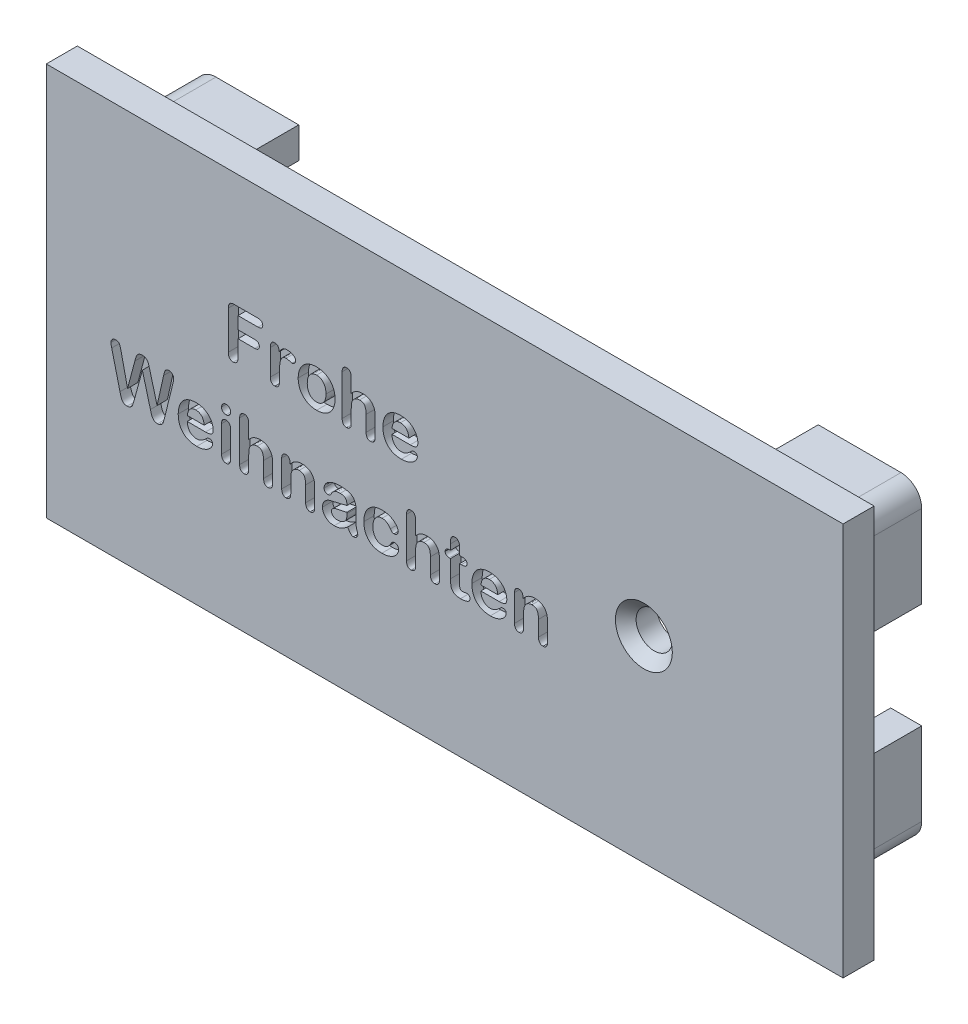
from build123d import *

# Parameters (mm, degrees)
SKIZZE4_W                       = 77
SKIZZE4_H                       = 38
SKIZZE4_R                       = 1.75
AUFSATZ_LINEAR_AUSTRAGEN1_DEPTH = 3
AUFSATZ_LINEAR_AUSTRAGEN2_DEPTH = 8
AUFSATZ_LINEAR_AUSTRAGEN3_DEPTH = 4
VERRUNDUNG1_R                   = 2
VERRUNDUNG3_R                   = 0.75
FASE2_SIZE                      = 1
SCHNITT_LINEAR_AUSTRAGEN1_DEPTH = 1


with BuildPart() as part:
    # Skizze4 → Aufsatz-Linear austragen1 (new body)
    with BuildSketch(Plane.XY):
        Rectangle(SKIZZE4_W, SKIZZE4_H)
        with Locations((19.25, 0)):
            Circle(SKIZZE4_R, mode=Mode.SUBTRACT)
    extrude(amount=AUFSATZ_LINEAR_AUSTRAGEN1_DEPTH)

    # Skizze5 → Aufsatz-Linear austragen2 (add)
    with BuildSketch(Plane(origin=(0, 0, 0), x_dir=(-1, 0, 0), z_dir=(0, 0, -1))):
        Polygon((-35.1, 5.1), (-35.1, 15.1), (-25.1, 15.1), (-25.1, 12.1), (-32.1, 12.1), (-32.1, 5.1), align=None)
        Polygon((32.1, 12.1), (32.1, 5.1), (35.1, 5.1), (35.1, 15.1), (25.1, 15.1), (25.1, 12.1), align=None)
        Polygon((25.1, -12.1), (32.1, -12.1), (32.1, -5.1), (35.1, -5.1), (35.1, -15.1), (25.1, -15.1), align=None)
        Polygon((-32.1, -12.1), (-32.1, -5.1), (-35.1, -5.1), (-35.1, -15.1), (-25.1, -15.1), (-25.1, -12.1), align=None)
    extrude(amount=AUFSATZ_LINEAR_AUSTRAGEN2_DEPTH)

    # Skizze6 → Aufsatz-Linear austragen3 (add)
    with BuildSketch(Plane(origin=(0, 0, 0), x_dir=(-1, 0, 0), z_dir=(0, 0, -1))):
        with BuildLine():
            Line((-25.287036414, 1.617619032), (-27.218888067, 2.135257122))
            ThreePointArc((-27.218888067, 2.135257122), (-25.083630945, 5.833630945), (-21.385257122, 7.968888067))
            Line((-21.385257122, 7.968888067), (-20.867619032, 6.037036414))
            ThreePointArc((-20.867619032, 6.037036414), (-23.669417382, 4.419417382), (-25.287036414, 1.617619032))
        make_face()
        with BuildLine():
            Line((-11.281111933, -2.135257122), (-13.212963586, -1.617619032))
            ThreePointArc((-13.212963586, -1.617619032), (-13.212963586, 1.617619032), (-14.830582618, 4.419417382))
            Line((-14.830582618, 4.419417382), (-13.416369055, 5.833630945))
            ThreePointArc((-13.416369055, 5.833630945), (-11.281111933, 2.135257122), (-11.281111933, -2.135257122))
        make_face()
        with BuildLine():
            Line((-25.083630945, -5.833630945), (-23.669417382, -4.419417382))
            ThreePointArc((-23.669417382, -4.419417382), (-20.867619032, -6.037036414), (-17.632380968, -6.037036414))
            Line((-17.632380968, -6.037036414), (-17.114742878, -7.968888067))
            ThreePointArc((-17.114742878, -7.968888067), (-21.385257122, -7.968888067), (-25.083630945, -5.833630945))
        make_face()
    extrude(amount=AUFSATZ_LINEAR_AUSTRAGEN3_DEPTH)

    # Verrundung1
    verrundung1_edges = [part.edges().sort_by_distance(p)[0] for p in [
        (32.1, 12.1, -4),
        (35.1, 15.1, -4),
        (-32.1, 12.1, -4),
        (-35.1, 15.1, -4),
        (-35.1, -15.1, -4),
        (-32.1, -12.1, -4),
        (32.1, -12.1, -4),
        (35.1, -15.1, -4),
    ]]
    fillet(verrundung1_edges, radius=VERRUNDUNG1_R)

    # Verrundung3
    verrundung3_edges = [part.edges().sort_by_distance(p)[0] for p in [
        (14.830582618, 4.419417382, -2),
        (13.212963586, -1.617619032, -2),
        (17.632380968, -6.037036414, -2),
        (23.669417382, -4.419417382, -2),
        (25.287036414, 1.617619032, -2),
        (20.867619032, 6.037036414, -2),
    ]]
    fillet(verrundung3_edges, radius=VERRUNDUNG3_R)

    # Fase2
    fase2_edges = [part.edges().sort_by_distance(p)[0] for p in [
        (17.5, 0, 3),
    ]]
    chamfer(fase2_edges, length=FASE2_SIZE)

    # Skizze7 → Schnitt-Linear austragen1 (cut)
    # profile 1 of 17: a face of its own
    with BuildSketch(Plane.XY.offset(3)):
        with BuildLine():
            Line((-18.040039063, 7.203146071), (-19.96875, 7.203146071))
            Line((-19.96875, 7.203146071), (-19.96875, 6.015646071))
            Line((-19.96875, 6.015646071), (-18.356445312, 6.015646071))
            add(Edge.make_bspline(
                [(-18.356445312, 6.015646071), (-18.321541821, 6.014293047), (-18.25574106, 6.011742299), (-18.163472949, 5.99411893), (-18.085236901, 5.961574425), (-18.021160243, 5.916254365), (-17.972592218, 5.858799006), (-17.936607553, 5.793597479), (-17.915525618, 5.71873269), (-17.913282303, 5.666173692), (-17.912109375, 5.638692946)],
                knots=[0, 0, 0, 0, 1.26669481, 2.387998457, 3.388485007, 4.319542635, 5.207485584, 6.095585677, 7.004267047, 8, 8, 8, 8], degree=3))
            add(Edge.make_bspline(
                [(-17.912109375, 5.638692946), (-17.913187411, 5.611500216), (-17.915264616, 5.559104106), (-17.937951451, 5.485018533), (-17.973127245, 5.419271633), (-18.023297752, 5.363421808), (-18.087178151, 5.318506705), (-18.165514035, 5.28792885), (-18.256481401, 5.267856207), (-18.321817105, 5.266411678), (-18.356445312, 5.265646071)],
                knots=[0, 0, 0, 0, 0.989228558, 1.906087716, 2.798941975, 3.690531566, 4.619691956, 5.620966574, 6.739101907, 8, 8, 8, 8], degree=3))
            Line((-18.356445312, 5.265646071), (-19.96875, 5.265646071))
            Line((-19.96875, 5.265646071), (-19.96875, 3.674825758))
            add(Edge.make_bspline(
                [(-19.96875, 3.674825758), (-19.969982444, 3.627505908), (-19.972305058, 3.538328825), (-19.996242027, 3.414098867), (-20.036702777, 3.308403548), (-20.09569603, 3.223745726), (-20.166566223, 3.157986338), (-20.248500783, 3.112342034), (-20.338743858, 3.082209835), (-20.402746156, 3.079523036), (-20.435546875, 3.078146071)],
                knots=[0, 0, 0, 0, 1.324745361, 2.496561692, 3.52818871, 4.472071426, 5.363073267, 6.212819431, 7.084082786, 8, 8, 8, 8], degree=3))
            add(Edge.make_bspline(
                [(-20.435546875, 3.078146071), (-20.469003905, 3.079489454), (-20.533979132, 3.08209837), (-20.625443778, 3.112375458), (-20.70831849, 3.157664342), (-20.779190357, 3.223812544), (-20.838618186, 3.308160934), (-20.876714193, 3.41360268), (-20.903345479, 3.535478446), (-20.905240706, 3.623217767), (-20.90625, 3.669942946)],
                knots=[0, 0, 0, 0, 0.935462148, 1.816714299, 2.675664794, 3.567975675, 4.513245122, 5.543029804, 6.691551627, 8, 8, 8, 8], degree=3))
            Line((-20.90625, 3.669942946), (-20.90625, 7.358419508))
            add(Edge.make_bspline(
                [(-20.90625, 7.358419508), (-20.905490077, 7.39165315), (-20.90404038, 7.455052549), (-20.893449446, 7.545694355), (-20.875562588, 7.626844128), (-20.848989715, 7.698579912), (-20.814346658, 7.76128041), (-20.771755988, 7.815981894), (-20.718128976, 7.859097365), (-20.657940747, 7.895219699), (-20.58817968, 7.920807405), (-20.510759178, 7.940813787), (-20.424081739, 7.950776376), (-20.363625717, 7.952332721), (-20.33203125, 7.953146071)],
                knots=[0, 0, 0, 0, 1.248307341, 2.381380143, 3.422634109, 4.362988604, 5.244318775, 6.105654139, 6.948029729, 7.814212849, 8.731706968, 9.728269157, 10.812787817, 12, 12, 12, 12], degree=3))
            Line((-20.33203125, 7.953146071), (-18.040039063, 7.953146071))
            add(Edge.make_bspline(
                [(-18.040039063, 7.953146071), (-18.003519415, 7.951794121), (-17.935152167, 7.949263178), (-17.839110973, 7.931856539), (-17.758636419, 7.898160123), (-17.692167381, 7.852910377), (-17.642175963, 7.795974687), (-17.604200127, 7.731781319), (-17.582615868, 7.658267837), (-17.58029303, 7.606600994), (-17.579101562, 7.580099196)],
                knots=[0, 0, 0, 0, 1.306215152, 2.44532304, 3.467849054, 4.404266228, 5.294549162, 6.155037916, 7.053652051, 8, 8, 8, 8], degree=3))
            add(Edge.make_bspline(
                [(-17.579101562, 7.580099196), (-17.580246496, 7.552932454), (-17.582465786, 7.500273621), (-17.604492598, 7.425395369), (-17.641529387, 7.359598923), (-17.692270471, 7.302517205), (-17.758393776, 7.256932324), (-17.839380696, 7.224753277), (-17.935107244, 7.206924721), (-18.003503774, 7.204461726), (-18.040039063, 7.203146071)],
                knots=[0, 0, 0, 0, 0.963504472, 1.867615256, 2.742849562, 3.627587234, 4.558171791, 5.569908026, 6.701920807, 8, 8, 8, 8], degree=3))
        make_face()
    # profile 2 of 17: a face of its own
    with BuildSketch(Plane.XY.offset(3)):
        with BuildLine():
            Line((-15.96875, 4.373067946), (-15.96875, 3.624044508))
            add(Edge.make_bspline(
                [(-15.96875, 3.624044508), (-15.970059438, 3.581280715), (-15.972531201, 3.500557593), (-15.995690807, 3.387777531), (-16.034558449, 3.291271946), (-16.090020904, 3.212959833), (-16.157392955, 3.152186453), (-16.234614988, 3.109329026), (-16.320265697, 3.083033112), (-16.380345424, 3.079801887), (-16.411132812, 3.078146071)],
                knots=[0, 0, 0, 0, 1.292414504, 2.439627698, 3.46375878, 4.417332263, 5.316903122, 6.185375834, 7.070109971, 8, 8, 8, 8], degree=3))
            add(Edge.make_bspline(
                [(-16.411132812, 3.078146071), (-16.441584615, 3.079800186), (-16.500694809, 3.083010999), (-16.585161902, 3.109092738), (-16.659820018, 3.153743637), (-16.726613421, 3.2135965), (-16.779451763, 3.292515943), (-16.817786671, 3.387463344), (-16.839691475, 3.498716537), (-16.842343054, 3.578045689), (-16.84375, 3.620138258)],
                knots=[0, 0, 0, 0, 0.933294383, 1.81162385, 2.680186499, 3.585258456, 4.541104918, 5.566887721, 6.708974649, 8, 8, 8, 8], degree=3))
            Line((-16.84375, 3.620138258), (-16.84375, 6.102560133))
            add(Edge.make_bspline(
                [(-16.84375, 6.102560133), (-16.842528669, 6.149512597), (-16.840234936, 6.237692124), (-16.821210664, 6.360968829), (-16.789141158, 6.466308403), (-16.741369919, 6.552683658), (-16.681123258, 6.621888813), (-16.604894241, 6.670285693), (-16.515165443, 6.697748639), (-16.451365691, 6.701291505), (-16.41796875, 6.703146071)],
                knots=[0, 0, 0, 0, 1.34619872, 2.528241455, 3.567694465, 4.487339067, 5.340335725, 6.171799567, 7.043000931, 8, 8, 8, 8], degree=3))
            add(Edge.make_bspline(
                [(-16.41796875, 6.703146071), (-16.383939945, 6.701614633), (-16.319998877, 6.698737018), (-16.231197012, 6.673439653), (-16.157537839, 6.629222057), (-16.100786215, 6.565834353), (-16.057353335, 6.48681846), (-16.025821714, 6.392203932), (-16.005953934, 6.281362482), (-16.000792236, 6.20225327), (-15.998046875, 6.160177321)],
                knots=[0, 0, 0, 0, 1.044883286, 1.963364657, 2.807970932, 3.650974255, 4.547373518, 5.563477854, 6.704082887, 8, 8, 8, 8], degree=3))
            add(Edge.make_bspline(
                [(-15.998046875, 6.160177321), (-15.971670171, 6.202601117), (-15.921220058, 6.283744133), (-15.838603963, 6.39354203), (-15.756272698, 6.487946886), (-15.67066858, 6.566897634), (-15.576692691, 6.630441394), (-15.468082564, 6.672902178), (-15.34592169, 6.69853856), (-15.259902142, 6.701562227), (-15.21484375, 6.703146071)],
                knots=[0, 0, 0, 0, 1.18924255, 2.274636787, 3.268721947, 4.168850259, 5.041860026, 5.953170485, 6.927838526, 8, 8, 8, 8], degree=3))
            add(Edge.make_bspline(
                [(-15.21484375, 6.703146071), (-15.167867827, 6.70133875), (-15.073569739, 6.697710786), (-14.933636045, 6.671858579), (-14.796258804, 6.627791009), (-14.68554089, 6.578702568), (-14.602842186, 6.531299095), (-14.547852476, 6.493161738), (-14.502202471, 6.450891986), (-14.463213715, 6.407026345), (-14.433326451, 6.359557331), (-14.412872515, 6.308902371), (-14.399330828, 6.255610491), (-14.398090097, 6.21885477), (-14.397460937, 6.200216383)],
                knots=[0, 0, 0, 0, 1.609451603, 3.230765888, 4.857137694, 6.544750347, 7.369389467, 8.121503283, 8.832102741, 9.496362917, 10.127778221, 10.743023735, 11.362602371, 12, 12, 12, 12], degree=3))
            add(Edge.make_bspline(
                [(-14.397460937, 6.200216383), (-14.398541042, 6.174310451), (-14.40063344, 6.124125002), (-14.42375732, 6.052838877), (-14.458835408, 5.98789591), (-14.509035785, 5.933473907), (-14.565975894, 5.888747053), (-14.627125205, 5.856075364), (-14.690733739, 5.835234584), (-14.734224937, 5.832457301), (-14.755859375, 5.831075758)],
                knots=[0, 0, 0, 0, 1.088483127, 2.10862957, 3.128406662, 4.178128692, 5.204900727, 6.16884502, 7.089102868, 8, 8, 8, 8], degree=3))
            add(Edge.make_bspline(
                [(-14.755859375, 5.831075758), (-14.766964033, 5.832155184), (-14.795695477, 5.834948016), (-14.846604692, 5.848161135), (-14.915443502, 5.866412618), (-14.996991667, 5.892171652), (-15.084265361, 5.920011028), (-15.171423131, 5.937675973), (-15.25254344, 5.950699868), (-15.304967003, 5.95235382), (-15.330078125, 5.953146071)],
                knots=[0, 0, 0, 0, 0.454029574, 1.174725489, 2.136679894, 3.357464208, 4.658256254, 5.865202561, 6.977422421, 8, 8, 8, 8], degree=3))
            add(Edge.make_bspline(
                [(-15.330078125, 5.953146071), (-15.361393884, 5.951695999), (-15.421999465, 5.948889666), (-15.509211433, 5.931238893), (-15.586379608, 5.896825054), (-15.655421552, 5.851581639), (-15.71495783, 5.791716039), (-15.767544457, 5.720295049), (-15.812512835, 5.635884553), (-15.85013523, 5.540043149), (-15.880633559, 5.433164769), (-15.90688387, 5.316749223), (-15.928498727, 5.190642188), (-15.943472803, 5.053629713), (-15.955299276, 4.904474724), (-15.962574945, 4.740964351), (-15.967556989, 4.562226252), (-15.96834142, 4.437850524), (-15.96875, 4.373067946)],
                knots=[0, 0, 0, 0, 0.794050632, 1.536731085, 2.238662641, 2.922771156, 3.616952249, 4.366019506, 5.163320251, 6.033432924, 6.970572952, 7.977209821, 9.05675488, 10.211001348, 11.468820729, 12.84806026, 14.358274693, 16, 16, 16, 16], degree=3))
        make_face()
    # profile 3 of 17: a face of its own
    with BuildSketch(Plane.XY.offset(3)):
        with BuildLine():
            add(Edge.make_bspline(
                [(-10.59375, 4.888692946), (-10.595194766, 4.823515803), (-10.598036184, 4.695332055), (-10.622125258, 4.507085668), (-10.660938098, 4.326590138), (-10.715620043, 4.154592674), (-10.784838298, 3.992323252), (-10.867810153, 3.841166618), (-10.965510224, 3.70207572), (-11.07663268, 3.575522111), (-11.200367549, 3.461123069), (-11.336803824, 3.361735256), (-11.483979671, 3.274886349), (-11.643025265, 3.203932405), (-11.812522963, 3.146593332), (-11.993042678, 3.107497334), (-12.183193864, 3.082075785), (-12.313391335, 3.079474526), (-12.379882812, 3.078146071)],
                knots=[0, 0, 0, 0, 1.091425222, 2.14650367, 3.173246554, 4.180341516, 5.164818684, 6.123963105, 7.063390915, 8.006199165, 8.940071845, 9.880179878, 10.828459563, 11.797350195, 12.792281962, 13.820196984, 14.886780802, 16, 16, 16, 16], degree=3))
            add(Edge.make_bspline(
                [(-12.379882812, 3.078146071), (-12.446066599, 3.079341648), (-12.575370203, 3.081677452), (-12.763716037, 3.10882223), (-12.942830868, 3.14746106), (-13.110750589, 3.205668955), (-13.268381468, 3.278399924), (-13.415156803, 3.365252238), (-13.550765516, 3.466681742), (-13.675064737, 3.580960876), (-13.786725562, 3.708311381), (-13.884337973, 3.847253407), (-13.968323769, 3.996903646), (-14.036210887, 4.157585894), (-14.090429885, 4.328150788), (-14.127553251, 4.508200497), (-14.152093542, 4.696613364), (-14.15484669, 4.825136444), (-14.15625, 4.890646071)],
                knots=[0, 0, 0, 0, 1.111227023, 2.171009928, 3.19145726, 4.186070048, 5.150303806, 6.104321695, 7.046220171, 7.990735544, 8.936485474, 9.886464991, 10.839039205, 11.814379169, 12.812535149, 13.84133354, 14.899703965, 16, 16, 16, 16], degree=3))
            add(Edge.make_bspline(
                [(-14.15625, 4.890646071), (-14.154852167, 4.956807607), (-14.152109335, 5.086629996), (-14.127481993, 5.276965151), (-14.090656087, 5.45914014), (-14.035225794, 5.631546421), (-13.966228796, 5.793898784), (-13.883028932, 5.94469662), (-13.787016771, 6.083576023), (-13.6769334, 6.209383949), (-13.553515669, 6.321721168), (-13.417827396, 6.421221869), (-13.269565622, 6.506163634), (-13.109944246, 6.577471126), (-12.939981648, 6.634379999), (-12.760537063, 6.673647779), (-12.573001193, 6.699193948), (-12.445073174, 6.701811965), (-12.379882812, 6.703146071)],
                knots=[0, 0, 0, 0, 1.109458584, 2.176983352, 3.214831729, 4.223461232, 5.209438476, 6.170044374, 7.10777617, 8.036608407, 8.968213882, 9.902121437, 10.853822319, 11.829170779, 12.830797886, 13.854949514, 14.906911741, 16, 16, 16, 16], degree=3))
            add(Edge.make_bspline(
                [(-12.379882812, 6.703146071), (-12.313723952, 6.701776893), (-12.183866011, 6.699089444), (-11.993877194, 6.674100213), (-11.81320935, 6.633455074), (-11.642901539, 6.575582816), (-11.483199345, 6.502881405), (-11.333916017, 6.417716759), (-11.198273319, 6.315511166), (-11.074345924, 6.201316278), (-10.961892481, 6.07517881), (-10.865567182, 5.935457179), (-10.781661881, 5.785367608), (-10.713676737, 5.623705103), (-10.660114348, 5.452299804), (-10.620780265, 5.272343876), (-10.598305558, 5.083275666), (-10.595290841, 4.954507267), (-10.59375, 4.888692946)],
                knots=[0, 0, 0, 0, 1.106546112, 2.171950929, 3.199928065, 4.200661522, 5.175688508, 6.132331741, 7.070262582, 8.010799296, 8.948477062, 9.891329305, 10.844648531, 11.82089183, 12.82003801, 13.845645933, 14.898896381, 16, 16, 16, 16], degree=3))
        make_face()
        with BuildLine():
            add(Edge.make_bspline(
                [(-11.46875, 4.888692946), (-11.469468859, 4.932011404), (-11.470866136, 5.016211388), (-11.482548995, 5.138653898), (-11.502607222, 5.253657782), (-11.527609862, 5.362035489), (-11.56390775, 5.462147408), (-11.604984759, 5.555877778), (-11.656766123, 5.640843582), (-11.71373316, 5.719451595), (-11.778670612, 5.788497696), (-11.847964391, 5.850065487), (-11.923957433, 5.900652202), (-12.004436075, 5.943528504), (-12.091032689, 5.975276599), (-12.182513553, 5.999176509), (-12.27954713, 6.012682254), (-12.345988886, 6.014644878), (-12.379882812, 6.015646071)],
                knots=[0, 0, 0, 0, 1.270558422, 2.469640054, 3.603049319, 4.693866399, 5.726721989, 6.722451407, 7.690273023, 8.639449843, 9.565088081, 10.465156222, 11.352368502, 12.23649231, 13.133922735, 14.051050542, 15.005782631, 16, 16, 16, 16], degree=3))
            add(Edge.make_bspline(
                [(-12.379882812, 6.015646071), (-12.423655701, 6.014446024), (-12.509061323, 6.012104602), (-12.632724814, 5.984939233), (-12.749233959, 5.944842544), (-12.856257226, 5.885221271), (-12.953470191, 5.810707098), (-13.040298906, 5.720395045), (-13.112810853, 5.612738565), (-13.174827068, 5.491272875), (-13.22158196, 5.355921746), (-13.257161487, 5.209891101), (-13.277528288, 5.052677371), (-13.279985362, 4.944414853), (-13.28125, 4.888692946)],
                knots=[0, 0, 0, 0, 0.966943267, 1.886610523, 2.788820013, 3.685057501, 4.584069546, 5.490925344, 6.443978365, 7.44584051, 8.500680597, 9.604835001, 10.767226511, 12, 12, 12, 12], degree=3))
            add(Edge.make_bspline(
                [(-13.28125, 4.888692946), (-13.28003162, 4.833609452), (-13.277665129, 4.726619411), (-13.256648297, 4.57126931), (-13.223162287, 4.426380347), (-13.175202915, 4.293026555), (-13.11532292, 4.172433734), (-13.041975865, 4.066530153), (-12.957896361, 3.974524998), (-12.861001325, 3.898797005), (-12.754153755, 3.838566832), (-12.63722384, 3.796706825), (-12.511578232, 3.770464282), (-12.424613286, 3.767282581), (-12.379882812, 3.765646071)],
                knots=[0, 0, 0, 0, 1.221452891, 2.372458373, 3.470695752, 4.514597835, 5.509283355, 6.448751658, 7.363470559, 8.263476682, 9.165479573, 10.07241203, 11.008543944, 12, 12, 12, 12], degree=3))
            add(Edge.make_bspline(
                [(-12.379882812, 3.765646071), (-12.345988579, 3.766646816), (-12.279546221, 3.768608561), (-12.182516964, 3.782120614), (-12.091020554, 3.805997822), (-12.004480083, 3.837827902), (-11.923632899, 3.880489325), (-11.848277829, 3.932336005), (-11.778610854, 3.993694162), (-11.713792521, 4.062862697), (-11.656419366, 4.14154559), (-11.605548021, 4.227014856), (-11.563596316, 4.320300753), (-11.527830595, 4.419977153), (-11.502561318, 4.527610702), (-11.482557974, 4.641661026), (-11.470893525, 4.762800025), (-11.469476485, 4.846025247), (-11.46875, 4.888692946)],
                knots=[0, 0, 0, 0, 0.996858043, 1.954125933, 2.873689662, 3.773503692, 4.659975762, 5.554937906, 6.457396659, 7.385493423, 8.337191288, 9.315813857, 10.305473609, 11.341072498, 12.425486328, 13.552469893, 14.745206377, 16, 16, 16, 16], degree=3))
        make_face(mode=Mode.SUBTRACT)
    # profile 4 of 17: a face of its own
    with BuildSketch(Plane.XY.offset(3)):
        with BuildLine():
            Line((-9.03125, 7.521505446), (-9.03125, 6.165060133))
            add(Edge.make_bspline(
                [(-9.03125, 6.165060133), (-9.002910354, 6.196272006), (-8.948261679, 6.256459331), (-8.863816149, 6.339329688), (-8.779902555, 6.41121973), (-8.697102943, 6.475151977), (-8.612049027, 6.52982893), (-8.52277778, 6.575440793), (-8.429766567, 6.61469098), (-8.332479214, 6.647010717), (-8.231018315, 6.672570218), (-8.125451179, 6.689613466), (-8.016515286, 6.700811366), (-7.942736689, 6.702359805), (-7.905273437, 6.703146071)],
                knots=[0, 0, 0, 0, 1.173663364, 2.263230367, 3.291514138, 4.248634038, 5.173853297, 6.102130553, 7.0363619, 7.982171909, 8.95377251, 9.946118989, 10.95708153, 12, 12, 12, 12], degree=3))
            add(Edge.make_bspline(
                [(-7.905273437, 6.703146071), (-7.849483897, 6.701648769), (-7.740452613, 6.698722543), (-7.581801108, 6.670206552), (-7.432652126, 6.625789067), (-7.293790303, 6.563042204), (-7.16737326, 6.482590481), (-7.053847666, 6.386135813), (-6.954401961, 6.272879645), (-6.902376334, 6.186454556), (-6.875976562, 6.142599196)],
                knots=[0, 0, 0, 0, 1.085792719, 2.121999479, 3.128983714, 4.110839156, 5.080082937, 6.038144847, 7.004480474, 8, 8, 8, 8], degree=3))
            add(Edge.make_bspline(
                [(-6.875976562, 6.142599196), (-6.86104162, 6.115550253), (-6.830839917, 6.060851404), (-6.796539347, 5.972708396), (-6.768734997, 5.880350869), (-6.749545481, 5.782781748), (-6.736710767, 5.679565397), (-6.725237858, 5.569580025), (-6.719918263, 5.451897209), (-6.719146511, 5.370792572), (-6.71875, 5.329122633)],
                knots=[0, 0, 0, 0, 0.883672694, 1.786978477, 2.700988214, 3.642194155, 4.629334876, 5.678070168, 6.807038951, 8, 8, 8, 8], degree=3))
            Line((-6.71875, 5.329122633), (-6.71875, 3.620138258))
            add(Edge.make_bspline(
                [(-6.71875, 3.620138258), (-6.720156763, 3.578045454), (-6.722807999, 3.498715858), (-6.744715075, 3.387465602), (-6.783042572, 3.292508619), (-6.835905765, 3.213621303), (-6.90282449, 3.153468191), (-6.978891773, 3.10865787), (-7.0661113, 3.082989371), (-7.127438476, 3.079797891), (-7.159179687, 3.078146071)],
                knots=[0, 0, 0, 0, 1.278705564, 2.409893971, 3.4258881, 4.372613266, 5.26904845, 6.137870482, 7.036214427, 8, 8, 8, 8], degree=3))
            add(Edge.make_bspline(
                [(-7.159179687, 3.078146071), (-7.19320212, 3.079735817), (-7.258070149, 3.082766867), (-7.348757827, 3.108151878), (-7.426122824, 3.151366746), (-7.48922159, 3.212515074), (-7.536332156, 3.291676882), (-7.570443879, 3.386366902), (-7.590425686, 3.497897209), (-7.592596859, 3.577735185), (-7.59375, 3.620138258)],
                knots=[0, 0, 0, 0, 1.028465874, 1.960899008, 2.821211708, 3.685183534, 4.587514, 5.584980556, 6.717349159, 8, 8, 8, 8], degree=3))
            Line((-7.59375, 3.620138258), (-7.59375, 5.126974196))
            add(Edge.make_bspline(
                [(-7.59375, 5.126974196), (-7.59414045, 5.16148369), (-7.594899845, 5.228602056), (-7.600322361, 5.32645556), (-7.611725072, 5.418196538), (-7.624402675, 5.504220928), (-7.643276604, 5.583394032), (-7.66553956, 5.656721391), (-7.693017456, 5.723381571), (-7.722804594, 5.78502353), (-7.759177831, 5.839940645), (-7.803786601, 5.886939751), (-7.854979361, 5.927879243), (-7.914753319, 5.959948949), (-7.981322717, 5.985468492), (-8.05530106, 6.0024969), (-8.136065634, 6.013475489), (-8.192343388, 6.014902305), (-8.221679687, 6.015646071)],
                knots=[0, 0, 0, 0, 1.321156362, 2.569549553, 3.748925732, 4.859330495, 5.896111096, 6.861778497, 7.789722651, 8.653531722, 9.479571747, 10.299479245, 11.124672869, 11.977991408, 12.885203854, 13.846358012, 14.877355937, 16, 16, 16, 16], degree=3))
            add(Edge.make_bspline(
                [(-8.221679687, 6.015646071), (-8.261530229, 6.013922605), (-8.340424266, 6.010510576), (-8.455395863, 5.984335032), (-8.564604884, 5.942004532), (-8.665793493, 5.882196271), (-8.757547312, 5.808081955), (-8.837912811, 5.720662935), (-8.906024314, 5.620682421), (-8.939854684, 5.546483083), (-8.95703125, 5.508810133)],
                knots=[0, 0, 0, 0, 1.007359208, 1.994317535, 2.966880073, 3.959729513, 4.955136837, 5.940031834, 6.954100135, 8, 8, 8, 8], degree=3))
            add(Edge.make_bspline(
                [(-8.95703125, 5.508810133), (-8.963239064, 5.490680088), (-8.976589881, 5.451688762), (-8.990296206, 5.386718802), (-9.002867746, 5.312765949), (-9.01384159, 5.229081425), (-9.021072504, 5.135516452), (-9.026837087, 5.032302231), (-9.031038725, 4.919325552), (-9.031177477, 4.840845568), (-9.03125, 4.799825758)],
                knots=[0, 0, 0, 0, 0.64207714, 1.380881253, 2.222518774, 3.158085183, 4.209618765, 5.368528601, 6.624586189, 8, 8, 8, 8], degree=3))
            Line((-9.03125, 4.799825758), (-9.03125, 3.620138258))
            add(Edge.make_bspline(
                [(-9.03125, 3.620138258), (-9.032213105, 3.5786675), (-9.034041972, 3.49991749), (-9.056881138, 3.389920681), (-9.092232059, 3.29423956), (-9.144918255, 3.215803015), (-9.210265713, 3.153724754), (-9.288078154, 3.109796669), (-9.377117408, 3.082485275), (-9.440547991, 3.079633521), (-9.473632812, 3.078146071)],
                knots=[0, 0, 0, 0, 1.252734673, 2.378853743, 3.382979341, 4.319939171, 5.211813387, 6.08527947, 7.001299006, 8, 8, 8, 8], degree=3))
            add(Edge.make_bspline(
                [(-9.473632812, 3.078146071), (-9.507657693, 3.07971498), (-9.572217116, 3.082691856), (-9.662739003, 3.108202109), (-9.739367616, 3.152150322), (-9.801815068, 3.214227008), (-9.850486897, 3.293394763), (-9.882308906, 3.390333265), (-9.903099654, 3.502717195), (-9.905157499, 3.583245517), (-9.90625, 3.625997633)],
                knots=[0, 0, 0, 0, 1.023773009, 1.942525452, 2.803784328, 3.656795395, 4.568506681, 5.576563358, 6.713408627, 8, 8, 8, 8], degree=3))
            Line((-9.90625, 3.625997633), (-9.90625, 7.530294508))
            add(Edge.make_bspline(
                [(-9.90625, 7.530294508), (-9.905229051, 7.573373228), (-9.903311365, 7.654289583), (-9.88179271, 7.766974806), (-9.847247339, 7.863315297), (-9.796923672, 7.94230862), (-9.732675163, 8.003625187), (-9.656491649, 8.047734578), (-9.568331888, 8.073389554), (-9.506029965, 8.076518836), (-9.473632812, 8.078146071)],
                knots=[0, 0, 0, 0, 1.30192003, 2.445444642, 3.455262964, 4.381401223, 5.252205646, 6.117141859, 7.020909143, 8, 8, 8, 8], degree=3))
            add(Edge.make_bspline(
                [(-9.473632812, 8.078146071), (-9.440560293, 8.076636226), (-9.377153294, 8.073741535), (-9.287793187, 8.046679481), (-9.210252694, 8.001436975), (-9.144558222, 7.938382218), (-9.092288198, 7.857989759), (-9.056579844, 7.759890929), (-9.034061472, 7.646229385), (-9.032221269, 7.564593364), (-9.03125, 7.521505446)],
                knots=[0, 0, 0, 0, 0.982212913, 1.8831094, 2.747001759, 3.63081186, 4.568452959, 5.574077653, 6.719585516, 8, 8, 8, 8], degree=3))
        make_face()
    # profile 5 of 17: a face of its own
    with BuildSketch(Plane.XY.offset(3)):
        with BuildLine():
            Line((-3.333007812, 4.703146071), (-5.09375, 4.703146071))
            add(Edge.make_bspline(
                [(-5.09375, 4.703146071), (-5.092028263, 4.654203442), (-5.088654517, 4.558300335), (-5.063285281, 4.419503326), (-5.025570088, 4.289144632), (-4.972974464, 4.16896207), (-4.907338664, 4.06104712), (-4.833268441, 3.964600025), (-4.74735453, 3.883844104), (-4.652037506, 3.817944393), (-4.548933441, 3.767630054), (-4.440695941, 3.72946661), (-4.326678215, 3.708116461), (-4.24910523, 3.704813026), (-4.209960938, 3.703146071)],
                knots=[0, 0, 0, 0, 1.179639705, 2.311504614, 3.392005435, 4.44652888, 5.46432702, 6.431680492, 7.370191764, 8.295643874, 9.215452015, 10.129041871, 11.055891293, 12, 12, 12, 12], degree=3))
            add(Edge.make_bspline(
                [(-4.209960938, 3.703146071), (-4.158418567, 3.705071843), (-4.059116635, 3.708782051), (-3.914749945, 3.73603451), (-3.780731589, 3.786644402), (-3.654196494, 3.855360799), (-3.536660722, 3.938437434), (-3.441851538, 4.013457332), (-3.366081072, 4.080572788), (-3.302258556, 4.139210041), (-3.229300786, 4.204534944), (-3.178946151, 4.251550105), (-3.15234375, 4.276388258)],
                knots=[0, 0, 0, 0, 1.247905556, 2.404224554, 3.538983975, 4.702801183, 5.881313568, 7.020008393, 7.628790321, 8.331868978, 9.11872483, 10, 10, 10, 10], degree=3))
            add(Edge.make_bspline(
                [(-3.15234375, 4.276388258), (-3.139972343, 4.285411189), (-3.114220488, 4.304192982), (-3.067033705, 4.322320537), (-3.012839994, 4.332768898), (-2.974336742, 4.3342196), (-2.954101562, 4.334982008)],
                knots=[0, 0, 0, 0, 0.868866131, 1.808598965, 2.848320883, 4, 4, 4, 4], degree=3))
            add(Edge.make_bspline(
                [(-2.954101562, 4.334982008), (-2.931853615, 4.334201823), (-2.889425447, 4.332713963), (-2.829501251, 4.317102205), (-2.775297179, 4.294196962), (-2.729263819, 4.259065382), (-2.690499235, 4.216602626), (-2.663710445, 4.164346019), (-2.646429545, 4.104961421), (-2.645182552, 4.062327653), (-2.64453125, 4.040060133)],
                knots=[0, 0, 0, 0, 1.102465736, 2.102468148, 3.057950005, 4.00546365, 4.956145095, 5.889200524, 6.897534264, 8, 8, 8, 8], degree=3))
            add(Edge.make_bspline(
                [(-2.64453125, 4.040060133), (-2.645810061, 4.018482389), (-2.648520968, 3.972740477), (-2.667295529, 3.901974879), (-2.698346909, 3.826700854), (-2.740296803, 3.747125403), (-2.793408634, 3.665103132), (-2.860972308, 3.585227323), (-2.939213043, 3.505698142), (-3.030116363, 3.428992474), (-3.13240888, 3.355560933), (-3.247745209, 3.288653006), (-3.376110245, 3.230082774), (-3.515437592, 3.175727103), (-3.666568719, 3.13174953), (-3.829414457, 3.101036736), (-4.002742745, 3.080770735), (-4.1223357, 3.0790351), (-4.18359375, 3.078146071)],
                knots=[0, 0, 0, 0, 0.525537938, 1.114069654, 1.772306998, 2.506549159, 3.302753817, 4.147512317, 5.050313588, 6.017967943, 7.041213872, 8.114344659, 9.260276936, 10.47524946, 11.755151616, 13.087980653, 14.508401902, 16, 16, 16, 16], degree=3))
            add(Edge.make_bspline(
                [(-4.18359375, 3.078146071), (-4.253640663, 3.079661957), (-4.390202014, 3.082617282), (-4.588595479, 3.105050642), (-4.774453253, 3.14271445), (-4.947333661, 3.196910945), (-5.108352474, 3.264647814), (-5.256172406, 3.349370187), (-5.39063054, 3.449660995), (-5.512370187, 3.564257179), (-5.619376051, 3.692843248), (-5.714076859, 3.83162419), (-5.792079964, 3.982563972), (-5.856909497, 4.143735294), (-5.907484874, 4.315762573), (-5.943476949, 4.49878454), (-5.965268829, 4.692523015), (-5.967571007, 4.825483782), (-5.96875, 4.893575758)],
                knots=[0, 0, 0, 0, 1.161895415, 2.265196273, 3.307380836, 4.303185105, 5.266158709, 6.199917451, 7.122316156, 8.043005893, 8.966794753, 9.89246016, 10.824859252, 11.779559524, 12.770652002, 13.794812853, 14.87067777, 16, 16, 16, 16], degree=3))
            add(Edge.make_bspline(
                [(-5.96875, 4.893575758), (-5.967569043, 4.958092982), (-5.965242065, 5.085218892), (-5.942871616, 5.272293667), (-5.908039785, 5.452260552), (-5.859614101, 5.624798942), (-5.796134137, 5.786990833), (-5.72109245, 5.93905509), (-5.631491173, 6.078142852), (-5.530094465, 6.206133097), (-5.413863153, 6.320097365), (-5.283863348, 6.420589435), (-5.139784768, 6.506440665), (-4.982495119, 6.577791054), (-4.813714508, 6.634486832), (-4.634245794, 6.673737405), (-4.445395626, 6.699267693), (-4.316167237, 6.701832728), (-4.25, 6.703146071)],
                knots=[0, 0, 0, 0, 1.095507523, 2.15860795, 3.195309999, 4.206995944, 5.197887526, 6.149926361, 7.082497361, 8.003040645, 8.917987058, 9.840388418, 10.787726911, 11.760164811, 12.769081724, 13.806049167, 14.876658106, 16, 16, 16, 16], degree=3))
            add(Edge.make_bspline(
                [(-4.25, 6.703146071), (-4.206677249, 6.702799906), (-4.121841832, 6.702122039), (-3.997054238, 6.690412471), (-3.876689117, 6.674218277), (-3.76061455, 6.651375511), (-3.650010765, 6.61945475), (-3.54383878, 6.582442014), (-3.442150671, 6.538708714), (-3.34581626, 6.487419106), (-3.253860383, 6.432577264), (-3.169182017, 6.371010173), (-3.088598955, 6.308357139), (-3.014932121, 6.240003854), (-2.946512912, 6.168359945), (-2.885264606, 6.091699752), (-2.828703285, 6.012265572), (-2.763807175, 5.901486704), (-2.695857582, 5.759268643), (-2.635275488, 5.584625122), (-2.598661645, 5.407145372), (-2.594080251, 5.287945943), (-2.591796875, 5.228536696)],
                knots=[0, 0, 0, 0, 1.048847282, 2.053872234, 3.03283051, 3.989924751, 4.915857681, 5.818505585, 6.711913066, 7.593554535, 8.460263899, 9.302531452, 10.127499996, 10.930978608, 11.734070318, 12.524563272, 13.305443929, 14.093732096, 15.631266151, 17.114748765, 18.561984696, 20, 20, 20, 20], degree=3))
            add(Edge.make_bspline(
                [(-2.591796875, 5.228536696), (-2.592319925, 5.202145662), (-2.593317608, 5.151806458), (-2.601877904, 5.079730351), (-2.617266234, 5.015108487), (-2.639172491, 4.957493568), (-2.665694225, 4.906444274), (-2.699928619, 4.863570332), (-2.739531757, 4.827393038), (-2.80346291, 4.789307048), (-2.897266994, 4.753858996), (-3.025342257, 4.724019876), (-3.172660561, 4.705796026), (-3.277614079, 4.704061527), (-3.333007812, 4.703146071)],
                knots=[0, 0, 0, 0, 0.899856074, 1.716417764, 2.470354694, 3.159019517, 3.814679391, 4.423252287, 5.02068589, 5.633798556, 6.949059873, 8.421953477, 10.111532063, 12, 12, 12, 12], degree=3))
        make_face()
        with BuildLine():
            Line((-5.09375, 5.203146071), (-3.461914062, 5.203146071))
            add(Edge.make_bspline(
                [(-3.461914062, 5.203146071), (-3.464892903, 5.238705582), (-3.470688049, 5.307884368), (-3.489109043, 5.407502131), (-3.510760433, 5.500465714), (-3.539475947, 5.586320839), (-3.573342572, 5.665113401), (-3.612688521, 5.73775625), (-3.658394807, 5.802818213), (-3.709576333, 5.861039744), (-3.765865258, 5.912067685), (-3.826019779, 5.957148472), (-3.891343669, 5.994707856), (-3.961075642, 6.024502667), (-4.034285169, 6.049686087), (-4.112449379, 6.065455826), (-4.194310187, 6.07711571), (-4.250605863, 6.077798227), (-4.279296875, 6.078146071)],
                knots=[0, 0, 0, 0, 1.274652096, 2.479755284, 3.617009281, 4.684005428, 5.71065458, 6.679155714, 7.63137599, 8.546404667, 9.444107911, 10.342338794, 11.228430864, 12.129821099, 13.049645363, 13.989847955, 14.975528821, 16, 16, 16, 16], degree=3))
            add(Edge.make_bspline(
                [(-4.279296875, 6.078146071), (-4.306664404, 6.077251079), (-4.360269353, 6.075498054), (-4.439203311, 6.065968651), (-4.514131866, 6.048435449), (-4.58536161, 6.023617621), (-4.652897818, 5.99246244), (-4.716712665, 5.954119556), (-4.77660459, 5.908934997), (-4.832398273, 5.856772091), (-4.884400598, 5.798395184), (-4.93023007, 5.732644025), (-4.970246179, 5.660303766), (-5.006740848, 5.582314832), (-5.036873127, 5.496906165), (-5.06091008, 5.404678264), (-5.080546572, 5.306188144), (-5.089278711, 5.238040862), (-5.09375, 5.203146071)],
                knots=[0, 0, 0, 0, 0.988988761, 1.937138454, 2.867098831, 3.763434994, 4.657917626, 5.549380048, 6.447873833, 7.363218941, 8.304708192, 9.267190604, 10.251834605, 11.288414524, 12.374576878, 13.518478699, 14.729337904, 16, 16, 16, 16], degree=3))
        make_face(mode=Mode.SUBTRACT)
    # profile 6 of 17: a face of its own
    with BuildSketch(Plane.XY.offset(3)):
        with BuildLine():
            Line((-28.436523437, -4.888650804), (-29.213867187, -1.984353929))
            Line((-29.213867187, -1.984353929), (-30.000976562, -4.888650804))
            add(Edge.make_bspline(
                [(-30.000976562, -4.888650804), (-30.015666447, -4.939742778), (-30.042822643, -5.034193057), (-30.079801286, -5.165060492), (-30.115792845, -5.27160515), (-30.144720574, -5.360114751), (-30.177887639, -5.434721378), (-30.221489429, -5.500867561), (-30.272811851, -5.564770483), (-30.33524874, -5.622926534), (-30.407427563, -5.674560676), (-30.493436365, -5.708940193), (-30.589356632, -5.731221491), (-30.657088156, -5.73328082), (-30.692382812, -5.734353929)],
                knots=[0, 0, 0, 0, 1.593450199, 2.945703666, 4.074932583, 4.963578588, 5.736316224, 6.513047046, 7.331315113, 8.187222847, 9.064061049, 9.973669067, 10.944086134, 12, 12, 12, 12], degree=3))
            add(Edge.make_bspline(
                [(-30.692382812, -5.734353929), (-30.721077936, -5.733742549), (-30.776174455, -5.732568658), (-30.855007218, -5.71983285), (-30.925952544, -5.69838611), (-30.98947904, -5.668827501), (-31.046033657, -5.631166099), (-31.095660492, -5.58580796), (-31.140581711, -5.534237484), (-31.193365188, -5.453667125), (-31.248247483, -5.335969192), (-31.298034613, -5.181207041), (-31.337320009, -5.022048818), (-31.364793713, -4.917266088), (-31.377929687, -4.867166429)],
                knots=[0, 0, 0, 0, 0.844984364, 1.622425369, 2.344584211, 3.02258317, 3.679700754, 4.338496446, 4.99812959, 5.68983231, 7.169954297, 8.807945526, 10.473786272, 12, 12, 12, 12], degree=3))
            Line((-31.377929687, -4.867166429), (-32.177734375, -1.611307054))
            add(Edge.make_bspline(
                [(-32.177734375, -1.611307054), (-32.188570311, -1.567125704), (-32.208882614, -1.484306372), (-32.230962636, -1.367932174), (-32.246275278, -1.268273454), (-32.248835124, -1.207377547), (-32.25, -1.179666429)],
                knots=[0, 0, 0, 0, 1.244637899, 2.333112935, 3.241471125, 4, 4, 4, 4], degree=3))
            add(Edge.make_bspline(
                [(-32.25, -1.179666429), (-32.248810379, -1.149166365), (-32.246487924, -1.0896222), (-32.219137217, -1.005405513), (-32.179119572, -0.927635582), (-32.120424736, -0.861500136), (-32.052236333, -0.804004099), (-31.972446903, -0.764151937), (-31.885730957, -0.738150429), (-31.825064481, -0.735641101), (-31.793945312, -0.734353929)],
                knots=[0, 0, 0, 0, 1.026200576, 2.003414008, 2.96246285, 3.960541354, 4.968440915, 5.956723063, 6.951891004, 8, 8, 8, 8], degree=3))
            add(Edge.make_bspline(
                [(-31.793945312, -0.734353929), (-31.772770542, -0.734985101), (-31.731897821, -0.736203423), (-31.673128418, -0.743538239), (-31.619937288, -0.757689886), (-31.57162589, -0.775283981), (-31.52994424, -0.801007582), (-31.492195504, -0.829826914), (-31.460709509, -0.865502703), (-31.425823918, -0.922564636), (-31.38789893, -1.006466212), (-31.34794007, -1.122281852), (-31.308075372, -1.256579299), (-31.287374225, -1.353642663), (-31.276367187, -1.405252367)],
                knots=[0, 0, 0, 0, 0.808122328, 1.559882671, 2.252704358, 2.905404214, 3.512433654, 4.113718811, 4.711917797, 5.314868035, 6.65938252, 8.214937873, 9.987439056, 12, 12, 12, 12], degree=3))
            Line((-31.276367187, -1.405252367), (-30.646484375, -4.234353929))
            Line((-30.646484375, -4.234353929), (-29.94140625, -1.586892992))
            add(Edge.make_bspline(
                [(-29.94140625, -1.586892992), (-29.928899918, -1.53931619), (-29.905366868, -1.449791357), (-29.869543976, -1.32498062), (-29.835464585, -1.218443226), (-29.803036723, -1.127129458), (-29.766547002, -1.046969876), (-29.720081377, -0.97504838), (-29.66343164, -0.909288969), (-29.598454644, -0.847971067), (-29.520778182, -0.795948319), (-29.429070368, -0.760647378), (-29.325730344, -0.73705984), (-29.252426493, -0.735286658), (-29.213867187, -0.734353929)],
                knots=[0, 0, 0, 0, 1.431879488, 2.694354579, 3.779085509, 4.687368261, 5.51393756, 6.336587382, 7.17007913, 8.035022418, 8.931165, 9.870736774, 10.879964543, 12, 12, 12, 12], degree=3))
            add(Edge.make_bspline(
                [(-29.213867187, -0.734353929), (-29.175018484, -0.735789038), (-29.101157809, -0.738517523), (-28.997083518, -0.760587416), (-28.906666704, -0.799075567), (-28.831410495, -0.852989472), (-28.768495513, -0.914369807), (-28.716582449, -0.979547053), (-28.673040331, -1.046277173), (-28.641327932, -1.120863745), (-28.612550727, -1.207636048), (-28.579377312, -1.313143566), (-28.541259713, -1.441968884), (-28.515742049, -1.536052978), (-28.501953125, -1.586892992)],
                knots=[0, 0, 0, 0, 1.14054899, 2.168456379, 3.106445743, 4.005812281, 4.871449232, 5.680910185, 6.450289684, 7.203755686, 8.053559891, 9.136318933, 10.452559013, 12, 12, 12, 12], degree=3))
            Line((-28.501953125, -1.586892992), (-27.791015625, -4.234353929))
            Line((-27.791015625, -4.234353929), (-27.161132812, -1.405252367))
            add(Edge.make_bspline(
                [(-27.161132812, -1.405252367), (-27.153851759, -1.370375863), (-27.140067992, -1.304351127), (-27.117440176, -1.211659548), (-27.09608052, -1.130884711), (-27.075795941, -1.059882189), (-27.051139851, -0.996676994), (-27.019470196, -0.938193635), (-26.980106825, -0.883712367), (-26.934368127, -0.832089582), (-26.878666778, -0.786684412), (-26.809382037, -0.755818155), (-26.729845506, -0.736978391), (-26.67329356, -0.735258412), (-26.643554687, -0.734353929)],
                knots=[0, 0, 0, 0, 1.365133971, 2.584336173, 3.655375053, 4.566954256, 5.412386126, 6.249588628, 7.10798716, 7.982279155, 8.888122676, 9.836835566, 10.862460541, 12, 12, 12, 12], degree=3))
            add(Edge.make_bspline(
                [(-26.643554687, -0.734353929), (-26.612799111, -0.735760648), (-26.552935524, -0.738498729), (-26.466698272, -0.762770794), (-26.388285699, -0.803784325), (-26.318689503, -0.859343421), (-26.259573837, -0.925729933), (-26.2179425, -1.003424507), (-26.191112764, -1.088716889), (-26.188723692, -1.148860594), (-26.1875, -1.179666429)],
                knots=[0, 0, 0, 0, 1.03699291, 2.018434435, 2.996793341, 4.006213175, 5.011314616, 5.975429195, 6.96300709, 8, 8, 8, 8], degree=3))
            add(Edge.make_bspline(
                [(-26.1875, -1.179666429), (-26.188815471, -1.205407227), (-26.191806752, -1.263939877), (-26.205008135, -1.361941613), (-26.229657575, -1.479792515), (-26.249191976, -1.565120449), (-26.259765625, -1.611307054)],
                knots=[0, 0, 0, 0, 0.70532364, 1.603853198, 2.703005224, 4, 4, 4, 4], degree=3))
            Line((-26.259765625, -1.611307054), (-27.059570312, -4.867166429))
            add(Edge.make_bspline(
                [(-27.059570312, -4.867166429), (-27.072367293, -4.918332401), (-27.096220645, -5.0137049), (-27.132615077, -5.145396855), (-27.164209245, -5.255750678), (-27.193976758, -5.347065122), (-27.225620038, -5.425737368), (-27.267687934, -5.495641494), (-27.318376815, -5.561352427), (-27.379171055, -5.621142922), (-27.450288919, -5.673931345), (-27.537734796, -5.708285314), (-27.636789884, -5.731598466), (-27.707852104, -5.733406037), (-27.745117187, -5.734353929)],
                knots=[0, 0, 0, 0, 1.552883699, 2.894548732, 4.02287014, 4.932163049, 5.722544985, 6.513217449, 7.326118303, 8.159774563, 9.018830479, 9.912428932, 10.905276121, 12, 12, 12, 12], degree=3))
            add(Edge.make_bspline(
                [(-27.745117187, -5.734353929), (-27.780402799, -5.733267961), (-27.848116965, -5.731183955), (-27.944156873, -5.709072745), (-28.029831991, -5.674071017), (-28.10315029, -5.624704017), (-28.164224688, -5.566348385), (-28.216618256, -5.504647289), (-28.259211608, -5.439199288), (-28.291796497, -5.365540764), (-28.321187029, -5.278369642), (-28.355591628, -5.170662219), (-28.394007445, -5.037867328), (-28.421587838, -4.941069627), (-28.436523437, -4.888650804)],
                knots=[0, 0, 0, 0, 1.054963199, 2.024506573, 2.933295648, 3.811943645, 4.653302703, 5.455819296, 6.231850806, 6.982109028, 7.860757024, 8.985975481, 10.367816402, 12, 12, 12, 12], degree=3))
        make_face()
    # profile 7 of 17: a face of its own
    with BuildSketch(Plane.XY.offset(3)):
        with BuildLine():
            Line((-23.114257812, -4.109353929), (-24.875, -4.109353929))
            add(Edge.make_bspline(
                [(-24.875, -4.109353929), (-24.873278263, -4.158296558), (-24.869904517, -4.254199665), (-24.844535281, -4.392996674), (-24.806820088, -4.523355368), (-24.754224464, -4.64353793), (-24.688588664, -4.75145288), (-24.614518441, -4.847899975), (-24.52860453, -4.928655896), (-24.433287506, -4.994555607), (-24.330183441, -5.044869946), (-24.221945941, -5.08303339), (-24.107928215, -5.104383539), (-24.03035523, -5.107686974), (-23.991210937, -5.109353929)],
                knots=[0, 0, 0, 0, 1.179639705, 2.311504614, 3.392005435, 4.44652888, 5.46432702, 6.431680492, 7.370191764, 8.295643874, 9.215452015, 10.129041871, 11.055891293, 12, 12, 12, 12], degree=3))
            add(Edge.make_bspline(
                [(-23.991210937, -5.109353929), (-23.939668567, -5.107428157), (-23.840366635, -5.103717949), (-23.695999945, -5.07646549), (-23.561981589, -5.025855598), (-23.435446494, -4.957139201), (-23.317910722, -4.874062566), (-23.223101538, -4.799042668), (-23.147331072, -4.731927212), (-23.083508556, -4.673289959), (-23.010550786, -4.607965056), (-22.960196151, -4.560949895), (-22.93359375, -4.536111742)],
                knots=[0, 0, 0, 0, 1.247905556, 2.404224554, 3.538983975, 4.702801183, 5.881313568, 7.020008393, 7.628790321, 8.331868978, 9.11872483, 10, 10, 10, 10], degree=3))
            add(Edge.make_bspline(
                [(-22.93359375, -4.536111742), (-22.921222343, -4.527088811), (-22.895470488, -4.508307018), (-22.848283705, -4.490179463), (-22.794089994, -4.479731102), (-22.755586742, -4.4782804), (-22.735351562, -4.477517992)],
                knots=[0, 0, 0, 0, 0.868866131, 1.808598965, 2.848320883, 4, 4, 4, 4], degree=3))
            add(Edge.make_bspline(
                [(-22.735351562, -4.477517992), (-22.713103615, -4.478298177), (-22.670675447, -4.479786037), (-22.610751251, -4.495397795), (-22.556547179, -4.518303038), (-22.510513819, -4.553434618), (-22.471749235, -4.595897374), (-22.444960445, -4.648153981), (-22.427679545, -4.707538579), (-22.426432552, -4.750172347), (-22.42578125, -4.772439867)],
                knots=[0, 0, 0, 0, 1.102465736, 2.102468148, 3.057950005, 4.00546365, 4.956145095, 5.889200524, 6.897534264, 8, 8, 8, 8], degree=3))
            add(Edge.make_bspline(
                [(-22.42578125, -4.772439867), (-22.427060061, -4.794017611), (-22.429770968, -4.839759523), (-22.448545529, -4.910525121), (-22.479596909, -4.985799146), (-22.521546803, -5.065374597), (-22.574658634, -5.147396868), (-22.642222308, -5.227272677), (-22.720463043, -5.306801858), (-22.811366363, -5.383507526), (-22.91365888, -5.456939067), (-23.028995209, -5.523846994), (-23.157360245, -5.582417226), (-23.296687592, -5.636772897), (-23.447818719, -5.68075047), (-23.610664457, -5.711463264), (-23.783992745, -5.731729265), (-23.9035857, -5.7334649), (-23.96484375, -5.734353929)],
                knots=[0, 0, 0, 0, 0.525537938, 1.114069654, 1.772306998, 2.506549159, 3.302753817, 4.147512317, 5.050313588, 6.017967943, 7.041213872, 8.114344659, 9.260276936, 10.47524946, 11.755151616, 13.087980653, 14.508401902, 16, 16, 16, 16], degree=3))
            add(Edge.make_bspline(
                [(-23.96484375, -5.734353929), (-24.034890663, -5.732838043), (-24.171452014, -5.729882718), (-24.369845479, -5.707449358), (-24.555703253, -5.66978555), (-24.728583661, -5.615589055), (-24.889602474, -5.547852186), (-25.037422406, -5.463129813), (-25.17188054, -5.362839005), (-25.293620187, -5.248242821), (-25.400626051, -5.119656752), (-25.495326859, -4.98087581), (-25.573329964, -4.829936028), (-25.638159497, -4.668764706), (-25.688734874, -4.496737427), (-25.724726949, -4.31371546), (-25.746518829, -4.119976985), (-25.748821007, -3.987016218), (-25.75, -3.918924242)],
                knots=[0, 0, 0, 0, 1.161895415, 2.265196273, 3.307380836, 4.303185105, 5.266158709, 6.199917451, 7.122316156, 8.043005893, 8.966794753, 9.89246016, 10.824859252, 11.779559524, 12.770652002, 13.794812853, 14.87067777, 16, 16, 16, 16], degree=3))
            add(Edge.make_bspline(
                [(-25.75, -3.918924242), (-25.748819043, -3.854407018), (-25.746492065, -3.727281108), (-25.724121616, -3.540206333), (-25.689289785, -3.360239448), (-25.640864101, -3.187701058), (-25.577384137, -3.025509167), (-25.50234245, -2.87344491), (-25.412741173, -2.734357148), (-25.311344465, -2.606366903), (-25.195113153, -2.492402635), (-25.065113348, -2.391910565), (-24.921034768, -2.306059335), (-24.763745119, -2.234708946), (-24.594964508, -2.178013168), (-24.415495794, -2.138762595), (-24.226645626, -2.113232307), (-24.097417237, -2.110667272), (-24.03125, -2.109353929)],
                knots=[0, 0, 0, 0, 1.095507523, 2.15860795, 3.195309999, 4.206995944, 5.197887526, 6.149926361, 7.082497361, 8.003040645, 8.917987058, 9.840388418, 10.787726911, 11.760164811, 12.769081724, 13.806049167, 14.876658106, 16, 16, 16, 16], degree=3))
            add(Edge.make_bspline(
                [(-24.03125, -2.109353929), (-23.987927249, -2.109700094), (-23.903091832, -2.110377961), (-23.778304238, -2.122087529), (-23.657939117, -2.138281723), (-23.54186455, -2.161124489), (-23.431260765, -2.19304525), (-23.32508878, -2.230057986), (-23.223400671, -2.273791286), (-23.12706626, -2.325080894), (-23.035110383, -2.379922736), (-22.950432017, -2.441489827), (-22.869848955, -2.504142861), (-22.796182121, -2.572496146), (-22.727762912, -2.644140055), (-22.666514606, -2.720800248), (-22.609953285, -2.800234428), (-22.545057175, -2.911013296), (-22.477107582, -3.053231357), (-22.416525488, -3.227874878), (-22.379911645, -3.405354628), (-22.375330251, -3.524554057), (-22.373046875, -3.583963304)],
                knots=[0, 0, 0, 0, 1.048847282, 2.053872234, 3.03283051, 3.989924751, 4.915857681, 5.818505585, 6.711913066, 7.593554535, 8.460263899, 9.302531452, 10.127499996, 10.930978608, 11.734070318, 12.524563272, 13.305443929, 14.093732096, 15.631266151, 17.114748765, 18.561984696, 20, 20, 20, 20], degree=3))
            add(Edge.make_bspline(
                [(-22.373046875, -3.583963304), (-22.373569925, -3.610354338), (-22.374567608, -3.660693542), (-22.383127904, -3.732769649), (-22.398516234, -3.797391513), (-22.420422491, -3.855006432), (-22.446944225, -3.906055726), (-22.481178619, -3.948929668), (-22.520781757, -3.985106962), (-22.58471291, -4.023192952), (-22.678516994, -4.058641004), (-22.806592257, -4.088480124), (-22.953910561, -4.106703974), (-23.058864079, -4.108438473), (-23.114257812, -4.109353929)],
                knots=[0, 0, 0, 0, 0.899856074, 1.716417764, 2.470354694, 3.159019517, 3.814679391, 4.423252287, 5.02068589, 5.633798556, 6.949059873, 8.421953477, 10.111532063, 12, 12, 12, 12], degree=3))
        make_face()
        with BuildLine():
            Line((-24.875, -3.609353929), (-23.243164062, -3.609353929))
            add(Edge.make_bspline(
                [(-23.243164062, -3.609353929), (-23.246142903, -3.573794418), (-23.251938049, -3.504615632), (-23.270359043, -3.404997869), (-23.292010433, -3.312034286), (-23.320725947, -3.226179161), (-23.354592572, -3.147386599), (-23.393938521, -3.07474375), (-23.439644807, -3.009681787), (-23.490826333, -2.951460256), (-23.547115258, -2.900432315), (-23.607269779, -2.855351528), (-23.672593669, -2.817792144), (-23.742325642, -2.787997333), (-23.815535169, -2.762813913), (-23.893699379, -2.747044174), (-23.975560187, -2.73538429), (-24.031855863, -2.734701773), (-24.060546875, -2.734353929)],
                knots=[0, 0, 0, 0, 1.274652096, 2.479755284, 3.617009281, 4.684005428, 5.71065458, 6.679155714, 7.63137599, 8.546404667, 9.444107911, 10.342338794, 11.228430864, 12.129821099, 13.049645363, 13.989847955, 14.975528821, 16, 16, 16, 16], degree=3))
            add(Edge.make_bspline(
                [(-24.060546875, -2.734353929), (-24.087914404, -2.735248921), (-24.141519353, -2.737001946), (-24.220453311, -2.746531349), (-24.295381866, -2.764064551), (-24.36661161, -2.788882379), (-24.434147818, -2.82003756), (-24.497962665, -2.858380444), (-24.55785459, -2.903565003), (-24.613648273, -2.955727909), (-24.665650598, -3.014104816), (-24.71148007, -3.079855975), (-24.751496179, -3.152196234), (-24.787990848, -3.230185168), (-24.818123127, -3.315593835), (-24.84216008, -3.407821736), (-24.861796572, -3.506311856), (-24.870528711, -3.574459138), (-24.875, -3.609353929)],
                knots=[0, 0, 0, 0, 0.988988761, 1.937138454, 2.867098831, 3.763434994, 4.657917626, 5.549380048, 6.447873833, 7.363218941, 8.304708192, 9.267190604, 10.251834605, 11.288414524, 12.374576878, 13.518478699, 14.729337904, 16, 16, 16, 16], degree=3))
        make_face(mode=Mode.SUBTRACT)
    # profile 8 of 17: a face of its own
    with BuildSketch(Plane.XY.offset(3)):
        with BuildLine():
            Line((-20.6875, -2.615213304), (-20.6875, -5.192361742))
            add(Edge.make_bspline(
                [(-20.6875, -5.192361742), (-20.688800045, -5.23447664), (-20.69125222, -5.313914788), (-20.714546163, -5.425076837), (-20.753574126, -5.520438722), (-20.808704805, -5.598655669), (-20.876431477, -5.659154278), (-20.953060065, -5.703386744), (-21.039055732, -5.72939677), (-21.099108989, -5.732674356), (-21.129882812, -5.734353929)],
                knots=[0, 0, 0, 0, 1.279660949, 2.41372764, 3.434282009, 4.393028164, 5.297478756, 6.175532382, 7.06506577, 8, 8, 8, 8], degree=3))
            add(Edge.make_bspline(
                [(-21.129882812, -5.734353929), (-21.160705318, -5.732841933), (-21.220327517, -5.729917171), (-21.305056205, -5.701969046), (-21.380789747, -5.657461453), (-21.445935771, -5.59445585), (-21.499287229, -5.515620339), (-21.535911018, -5.420463163), (-21.558549864, -5.31125829), (-21.56113322, -5.233500948), (-21.5625, -5.192361742)],
                knots=[0, 0, 0, 0, 0.944656094, 1.82731652, 2.710883517, 3.62364324, 4.589202842, 5.612771424, 6.736985008, 8, 8, 8, 8], degree=3))
            Line((-21.5625, -5.192361742), (-21.5625, -2.641580492))
            add(Edge.make_bspline(
                [(-21.5625, -2.641580492), (-21.561101876, -2.600125504), (-21.55845828, -2.521741759), (-21.536374344, -2.412360566), (-21.499468546, -2.318407866), (-21.445872834, -2.242153722), (-21.380334323, -2.182286421), (-21.304916598, -2.139530407), (-21.219987119, -2.114316168), (-21.160654984, -2.111048619), (-21.129882812, -2.109353929)],
                knots=[0, 0, 0, 0, 1.282601348, 2.425162879, 3.437763456, 4.38569495, 5.284727511, 6.164859808, 7.048218153, 8, 8, 8, 8], degree=3))
            add(Edge.make_bspline(
                [(-21.129882812, -2.109353929), (-21.09912871, -2.111119518), (-21.039206521, -2.114559644), (-20.953175398, -2.139261873), (-20.876407681, -2.182488878), (-20.809673665, -2.24179376), (-20.753985488, -2.315668365), (-20.715154971, -2.404596706), (-20.69136469, -2.50590476), (-20.688828537, -2.577637078), (-20.6875, -2.615213304)],
                knots=[0, 0, 0, 0, 0.975882645, 1.901438153, 2.812865763, 3.75006033, 4.717368935, 5.725761173, 6.808663735, 8, 8, 8, 8], degree=3))
        make_face()
    # profile 9 of 17: a face of its own
    with BuildSketch(Plane.XY.offset(3)):
        with BuildLine():
            add(Edge.make_bspline(
                [(-21.120117187, -1.671853929), (-21.149555149, -1.670702298), (-21.206994379, -1.668455239), (-21.289899119, -1.646003032), (-21.365798349, -1.609294306), (-21.434775332, -1.559814398), (-21.492108788, -1.495882079), (-21.534122896, -1.418497162), (-21.558699417, -1.328924294), (-21.561199295, -1.265434832), (-21.5625, -1.232400804)],
                knots=[0, 0, 0, 0, 1.006201835, 1.963296869, 2.915511555, 3.880878732, 4.85189213, 5.829536295, 6.870691953, 8, 8, 8, 8], degree=3))
            add(Edge.make_bspline(
                [(-21.5625, -1.232400804), (-21.560772572, -1.20196191), (-21.557424819, -1.142971405), (-21.532383612, -1.058296862), (-21.489331278, -0.983080402), (-21.431457401, -0.917698286), (-21.362664748, -0.864999182), (-21.287589096, -0.824321288), (-21.205414615, -0.801424288), (-21.148896896, -0.798395987), (-21.120117187, -0.796853929)],
                knots=[0, 0, 0, 0, 1.057408726, 2.04925565, 3.037480321, 4.047814229, 5.064214746, 6.036169889, 6.999986943, 8, 8, 8, 8], degree=3))
            add(Edge.make_bspline(
                [(-21.120117187, -0.796853929), (-21.092312481, -0.798094558), (-21.037858531, -0.80052426), (-20.958617498, -0.822056931), (-20.884862338, -0.857571138), (-20.817576084, -0.906560188), (-20.758091137, -0.967647838), (-20.717489754, -1.045375906), (-20.690610442, -1.134610884), (-20.688573495, -1.198650945), (-20.6875, -1.232400804)],
                knots=[0, 0, 0, 0, 0.967133894, 1.894077239, 2.837452275, 3.803721558, 4.782485793, 5.777084342, 6.828497526, 8, 8, 8, 8], degree=3))
            add(Edge.make_bspline(
                [(-20.6875, -1.232400804), (-20.688757499, -1.265134026), (-20.691173786, -1.328030966), (-20.716350333, -1.416477529), (-20.756650661, -1.494291447), (-20.814537968, -1.55743781), (-20.881442638, -1.607964584), (-20.955561414, -1.644926915), (-21.035658287, -1.668652467), (-21.091629231, -1.670774077), (-21.120117187, -1.671853929)],
                knots=[0, 0, 0, 0, 1.133982342, 2.178948973, 3.165031597, 4.149752721, 5.126395816, 6.06160272, 7.013399203, 8, 8, 8, 8], degree=3))
        make_face()
    # profile 10 of 17: a face of its own
    with BuildSketch(Plane.XY.offset(3)):
        with BuildLine():
            Line((-18.9375, -1.290994554), (-18.9375, -2.647439867))
            add(Edge.make_bspline(
                [(-18.9375, -2.647439867), (-18.909160354, -2.616227994), (-18.854511679, -2.556040669), (-18.770066149, -2.473170312), (-18.686152555, -2.40128027), (-18.603352943, -2.337348023), (-18.518299027, -2.28267107), (-18.42902778, -2.237059207), (-18.336016567, -2.19780902), (-18.238729214, -2.165489283), (-18.137268315, -2.139929782), (-18.031701179, -2.122886534), (-17.922765286, -2.111688634), (-17.848986689, -2.110140195), (-17.811523437, -2.109353929)],
                knots=[0, 0, 0, 0, 1.173663364, 2.263230367, 3.291514138, 4.248634038, 5.173853297, 6.102130553, 7.0363619, 7.982171909, 8.95377251, 9.946118989, 10.95708153, 12, 12, 12, 12], degree=3))
            add(Edge.make_bspline(
                [(-17.811523437, -2.109353929), (-17.755733897, -2.110851231), (-17.646702613, -2.113777457), (-17.488051108, -2.142293448), (-17.338902126, -2.186710933), (-17.200040303, -2.249457796), (-17.07362326, -2.329909519), (-16.960097666, -2.426364187), (-16.860651961, -2.539620355), (-16.808626334, -2.626045444), (-16.782226562, -2.669900804)],
                knots=[0, 0, 0, 0, 1.085792719, 2.121999479, 3.128983714, 4.110839156, 5.080082937, 6.038144847, 7.004480474, 8, 8, 8, 8], degree=3))
            add(Edge.make_bspline(
                [(-16.782226562, -2.669900804), (-16.76729162, -2.696949747), (-16.737089917, -2.751648596), (-16.702789347, -2.839791604), (-16.674984997, -2.932149131), (-16.655795481, -3.029718252), (-16.642960767, -3.132934603), (-16.631487858, -3.242919975), (-16.626168263, -3.360602791), (-16.625396511, -3.441707428), (-16.625, -3.483377367)],
                knots=[0, 0, 0, 0, 0.883672694, 1.786978477, 2.700988214, 3.642194155, 4.629334876, 5.678070168, 6.807038951, 8, 8, 8, 8], degree=3))
            Line((-16.625, -3.483377367), (-16.625, -5.192361742))
            add(Edge.make_bspline(
                [(-16.625, -5.192361742), (-16.626406763, -5.234454546), (-16.629057999, -5.313784142), (-16.650965075, -5.425034398), (-16.689292572, -5.519991381), (-16.742155765, -5.598878697), (-16.80907449, -5.659031809), (-16.885141773, -5.70384213), (-16.9723613, -5.729510629), (-17.033688476, -5.732702109), (-17.065429687, -5.734353929)],
                knots=[0, 0, 0, 0, 1.278705564, 2.409893971, 3.4258881, 4.372613266, 5.26904845, 6.137870482, 7.036214427, 8, 8, 8, 8], degree=3))
            add(Edge.make_bspline(
                [(-17.065429687, -5.734353929), (-17.09945212, -5.732764183), (-17.164320149, -5.729733133), (-17.255007827, -5.704348122), (-17.332372824, -5.661133254), (-17.39547159, -5.599984926), (-17.442582156, -5.520823118), (-17.476693879, -5.426133098), (-17.496675686, -5.314602791), (-17.498846859, -5.234764815), (-17.5, -5.192361742)],
                knots=[0, 0, 0, 0, 1.028465874, 1.960899008, 2.821211708, 3.685183534, 4.587514, 5.584980556, 6.717349159, 8, 8, 8, 8], degree=3))
            Line((-17.5, -5.192361742), (-17.5, -3.685525804))
            add(Edge.make_bspline(
                [(-17.5, -3.685525804), (-17.50039045, -3.65101631), (-17.501149845, -3.583897944), (-17.506572361, -3.48604444), (-17.517975072, -3.394303462), (-17.530652675, -3.308279072), (-17.549526604, -3.229105968), (-17.57178956, -3.155778609), (-17.599267456, -3.089118429), (-17.629054594, -3.02747647), (-17.665427831, -2.972559355), (-17.710036601, -2.925560249), (-17.761229361, -2.884620757), (-17.821003319, -2.852551051), (-17.887572717, -2.827031508), (-17.96155106, -2.8100031), (-18.042315634, -2.799024511), (-18.098593388, -2.797597695), (-18.127929687, -2.796853929)],
                knots=[0, 0, 0, 0, 1.321156362, 2.569549553, 3.748925732, 4.859330495, 5.896111096, 6.861778497, 7.789722651, 8.653531722, 9.479571747, 10.299479245, 11.124672869, 11.977991408, 12.885203854, 13.846358012, 14.877355937, 16, 16, 16, 16], degree=3))
            add(Edge.make_bspline(
                [(-18.127929687, -2.796853929), (-18.167780229, -2.798577395), (-18.246674266, -2.801989424), (-18.361645863, -2.828164968), (-18.470854884, -2.870495468), (-18.572043493, -2.930303729), (-18.663797312, -3.004418045), (-18.744162811, -3.091837065), (-18.812274314, -3.191817579), (-18.846104684, -3.266016917), (-18.86328125, -3.303689867)],
                knots=[0, 0, 0, 0, 1.007359208, 1.994317535, 2.966880073, 3.959729513, 4.955136837, 5.940031834, 6.954100135, 8, 8, 8, 8], degree=3))
            add(Edge.make_bspline(
                [(-18.86328125, -3.303689867), (-18.869489064, -3.321819912), (-18.882839881, -3.360811238), (-18.896546206, -3.425781198), (-18.909117746, -3.499734051), (-18.92009159, -3.583418575), (-18.927322504, -3.676983548), (-18.933087087, -3.780197769), (-18.937288725, -3.893174448), (-18.937427477, -3.971654432), (-18.9375, -4.012674242)],
                knots=[0, 0, 0, 0, 0.64207714, 1.380881253, 2.222518774, 3.158085183, 4.209618765, 5.368528601, 6.624586189, 8, 8, 8, 8], degree=3))
            Line((-18.9375, -4.012674242), (-18.9375, -5.192361742))
            add(Edge.make_bspline(
                [(-18.9375, -5.192361742), (-18.938463105, -5.2338325), (-18.940291972, -5.31258251), (-18.963131138, -5.422579319), (-18.998482059, -5.51826044), (-19.051168255, -5.596696985), (-19.116515713, -5.658775246), (-19.194328154, -5.702703331), (-19.283367408, -5.730014725), (-19.346797991, -5.732866479), (-19.379882812, -5.734353929)],
                knots=[0, 0, 0, 0, 1.252734673, 2.378853743, 3.382979341, 4.319939171, 5.211813387, 6.08527947, 7.001299006, 8, 8, 8, 8], degree=3))
            add(Edge.make_bspline(
                [(-19.379882812, -5.734353929), (-19.413907693, -5.73278502), (-19.478467116, -5.729808144), (-19.568989003, -5.704297891), (-19.645617616, -5.660349678), (-19.708065068, -5.598272992), (-19.756736897, -5.519105237), (-19.788558906, -5.422166735), (-19.809349654, -5.309782805), (-19.811407499, -5.229254483), (-19.8125, -5.186502367)],
                knots=[0, 0, 0, 0, 1.023773009, 1.942525452, 2.803784328, 3.656795395, 4.568506681, 5.576563358, 6.713408627, 8, 8, 8, 8], degree=3))
            Line((-19.8125, -5.186502367), (-19.8125, -1.282205492))
            add(Edge.make_bspline(
                [(-19.8125, -1.282205492), (-19.811479051, -1.239126772), (-19.809561365, -1.158210417), (-19.78804271, -1.045525194), (-19.753497339, -0.949184703), (-19.703173672, -0.87019138), (-19.638925163, -0.808874813), (-19.562741649, -0.764765422), (-19.474581888, -0.739110446), (-19.412279965, -0.735981164), (-19.379882812, -0.734353929)],
                knots=[0, 0, 0, 0, 1.30192003, 2.445444642, 3.455262964, 4.381401223, 5.252205646, 6.117141859, 7.020909143, 8, 8, 8, 8], degree=3))
            add(Edge.make_bspline(
                [(-19.379882812, -0.734353929), (-19.346810293, -0.735863774), (-19.283403294, -0.738758465), (-19.194043187, -0.765820519), (-19.116502694, -0.811063025), (-19.050808222, -0.874117782), (-18.998538198, -0.954510241), (-18.962829844, -1.052609071), (-18.940311472, -1.166270615), (-18.938471269, -1.247906636), (-18.9375, -1.290994554)],
                knots=[0, 0, 0, 0, 0.982212913, 1.8831094, 2.747001759, 3.63081186, 4.568452959, 5.574077653, 6.719585516, 8, 8, 8, 8], degree=3))
        make_face()
    # profile 11 of 17: a face of its own
    with BuildSketch(Plane.XY.offset(3)):
        with BuildLine():
            Line((-14.9296875, -2.601541429), (-14.9296875, -2.708963304))
            add(Edge.make_bspline(
                [(-14.9296875, -2.708963304), (-14.8899223, -2.659975476), (-14.812852072, -2.565030572), (-14.685321052, -2.43995487), (-14.551339404, -2.336450523), (-14.411449217, -2.251919579), (-14.262239449, -2.187541067), (-14.103761893, -2.142076676), (-13.934605576, -2.113749909), (-13.818474331, -2.110846253), (-13.758789062, -2.109353929)],
                knots=[0, 0, 0, 0, 1.105863122, 2.14330934, 3.124116013, 4.06884223, 5.002046541, 5.964948147, 6.954091843, 8, 8, 8, 8], degree=3))
            add(Edge.make_bspline(
                [(-13.758789062, -2.109353929), (-13.700730931, -2.111228688), (-13.587153504, -2.114896223), (-13.421658617, -2.143669583), (-13.265716297, -2.191809825), (-13.120333281, -2.258863202), (-12.988541069, -2.343714904), (-12.871948243, -2.444037077), (-12.775043861, -2.562492585), (-12.725900469, -2.65148677), (-12.701171875, -2.696267992)],
                knots=[0, 0, 0, 0, 1.092012857, 2.136272848, 3.149533556, 4.155305525, 5.139051171, 6.089806823, 7.038804796, 8, 8, 8, 8], degree=3))
            add(Edge.make_bspline(
                [(-12.701171875, -2.696267992), (-12.687159931, -2.723648279), (-12.659105397, -2.778468737), (-12.628939018, -2.866178294), (-12.603795899, -2.956040286), (-12.587591253, -3.051336146), (-12.57589012, -3.154369531), (-12.568630343, -3.2687752), (-12.563665383, -3.396094234), (-12.562901391, -3.485324862), (-12.5625, -3.532205492)],
                knots=[0, 0, 0, 0, 0.860987887, 1.723858877, 2.59364755, 3.474136303, 4.429262975, 5.499190641, 6.686106779, 8, 8, 8, 8], degree=3))
            Line((-12.5625, -3.532205492), (-12.5625, -5.192361742))
            add(Edge.make_bspline(
                [(-12.5625, -5.192361742), (-12.563905204, -5.234456337), (-12.566553502, -5.313789308), (-12.588480016, -5.425017236), (-12.626744105, -5.520047051), (-12.679684568, -5.598489625), (-12.745628266, -5.659376194), (-12.82120889, -5.703334018), (-12.906530687, -5.729508854), (-12.966288214, -5.732706677), (-12.997070312, -5.734353929)],
                knots=[0, 0, 0, 0, 1.287683965, 2.426814984, 3.449942892, 4.403315466, 5.298703094, 6.173625539, 7.059204068, 8, 8, 8, 8], degree=3))
            add(Edge.make_bspline(
                [(-12.997070312, -5.734353929), (-13.028532348, -5.732826955), (-13.089406555, -5.729872496), (-13.175862023, -5.702220828), (-13.252800103, -5.657486994), (-13.318963585, -5.594540713), (-13.373226744, -5.515698726), (-13.41115583, -5.420679973), (-13.433469789, -5.311229641), (-13.436105513, -5.233491035), (-13.4375, -5.192361742)],
                knots=[0, 0, 0, 0, 0.956888113, 1.851431539, 2.73651156, 3.649202174, 4.61265493, 5.631794413, 6.747049533, 8, 8, 8, 8], degree=3))
            Line((-13.4375, -5.192361742), (-13.4375, -3.705057054))
            add(Edge.make_bspline(
                [(-13.4375, -3.705057054), (-13.437850218, -3.669241151), (-13.43852887, -3.599837238), (-13.444437823, -3.499152802), (-13.454064073, -3.404951359), (-13.467663712, -3.317260568), (-13.484632021, -3.235769792), (-13.507747092, -3.161404126), (-13.532593629, -3.09286432), (-13.561716813, -3.030494671), (-13.597083357, -2.974722679), (-13.640451127, -2.925912774), (-13.692873125, -2.886004481), (-13.752562973, -2.853384056), (-13.819665899, -2.828161958), (-13.894638329, -2.809464931), (-13.977582215, -2.799211956), (-14.035455167, -2.797658514), (-14.065429687, -2.796853929)],
                knots=[0, 0, 0, 0, 1.347407926, 2.611001687, 3.793088521, 4.908587076, 5.948729011, 6.92120119, 7.835727118, 8.690310665, 9.505642719, 10.312189108, 11.132838799, 11.971477223, 12.863082387, 13.822511078, 14.872198764, 16, 16, 16, 16], degree=3))
            add(Edge.make_bspline(
                [(-14.065429687, -2.796853929), (-14.105615801, -2.798494033), (-14.184927777, -2.80173097), (-14.301119454, -2.8291436), (-14.411395322, -2.874553226), (-14.514403279, -2.937270363), (-14.608782201, -3.014016993), (-14.689428162, -3.106532994), (-14.758001852, -3.21151779), (-14.79088073, -3.289423738), (-14.807617187, -3.329080492)],
                knots=[0, 0, 0, 0, 0.990651567, 1.955166231, 2.927741695, 3.922358355, 4.92102128, 5.916966927, 6.939665927, 8, 8, 8, 8], degree=3))
            add(Edge.make_bspline(
                [(-14.807617187, -3.329080492), (-14.813084602, -3.347568577), (-14.824873117, -3.387431495), (-14.83816575, -3.453758088), (-14.849548943, -3.530693433), (-14.859529431, -3.618611379), (-14.865445274, -3.717396447), (-14.872004539, -3.826724938), (-14.874379317, -3.946909405), (-14.874787303, -4.030578286), (-14.875, -4.074197679)],
                knots=[0, 0, 0, 0, 0.61625433, 1.3287312, 2.16048812, 3.103078273, 4.156926102, 5.324424499, 6.605132795, 8, 8, 8, 8], degree=3))
            Line((-14.875, -4.074197679), (-14.875, -5.192361742))
            add(Edge.make_bspline(
                [(-14.875, -5.192361742), (-14.876221453, -5.234830105), (-14.878517093, -5.31464655), (-14.902639198, -5.425977226), (-14.939304694, -5.522308486), (-14.995687773, -5.599634135), (-15.062482694, -5.659994039), (-15.139358125, -5.70364383), (-15.225596419, -5.729385088), (-15.286285118, -5.732670461), (-15.317382812, -5.734353929)],
                knots=[0, 0, 0, 0, 1.287446969, 2.41967039, 3.443922091, 4.393062967, 5.2960435, 6.159191247, 7.056745165, 8, 8, 8, 8], degree=3))
            add(Edge.make_bspline(
                [(-15.317382812, -5.734353929), (-15.347861787, -5.732791589), (-15.407122867, -5.729753889), (-15.491462069, -5.702280215), (-15.566470685, -5.656809079), (-15.632589938, -5.594903012), (-15.685532373, -5.515335349), (-15.723735033, -5.420737842), (-15.745946278, -5.311212463), (-15.748597378, -5.233485091), (-15.75, -5.192361742)],
                knots=[0, 0, 0, 0, 0.935579112, 1.81907128, 2.69486961, 3.615758504, 4.582227965, 5.61052191, 6.735794854, 8, 8, 8, 8], degree=3))
            Line((-15.75, -5.192361742), (-15.75, -2.615213304))
            add(Edge.make_bspline(
                [(-15.75, -2.615213304), (-15.748898127, -2.575384525), (-15.746821884, -2.500335767), (-15.726165769, -2.395969981), (-15.694092245, -2.306331937), (-15.644906003, -2.234270525), (-15.583814745, -2.178177251), (-15.512505777, -2.137500037), (-15.430562305, -2.11324544), (-15.372891577, -2.110689008), (-15.342773437, -2.109353929)],
                knots=[0, 0, 0, 0, 1.29464202, 2.439474141, 3.448837032, 4.371523091, 5.248813216, 6.126614955, 7.021637581, 8, 8, 8, 8], degree=3))
            add(Edge.make_bspline(
                [(-15.342773437, -2.109353929), (-15.323857894, -2.110231507), (-15.287074342, -2.111938062), (-15.232983248, -2.121635117), (-15.182184428, -2.139552094), (-15.133925787, -2.163806315), (-15.090125318, -2.195706657), (-15.048561412, -2.232580999), (-15.015531107, -2.279710292), (-14.984313644, -2.331318279), (-14.960598358, -2.390444259), (-14.941180123, -2.454941975), (-14.932341294, -2.526436933), (-14.930596656, -2.575811579), (-14.9296875, -2.601541429)],
                knots=[0, 0, 0, 0, 0.943175954, 1.834119198, 2.726833115, 3.619252164, 4.515056339, 5.421956296, 6.372636641, 7.36874147, 8.423244244, 9.537454901, 10.716731755, 12, 12, 12, 12], degree=3))
        make_face()
    # profile 12 of 17: a face of its own
    with BuildSketch(Plane.XY.offset(3)):
        with BuildLine():
            add(Edge.make_bspline(
                [(-9.377929687, -5.196267992), (-9.430872345, -5.238824725), (-9.533370244, -5.321215295), (-9.689989611, -5.43202775), (-9.845681194, -5.522974508), (-9.998301326, -5.601870535), (-10.155691296, -5.661719458), (-10.320512396, -5.703279733), (-10.494612363, -5.729425605), (-10.613837766, -5.732686462), (-10.674804687, -5.734353929)],
                knots=[0, 0, 0, 0, 1.134976623, 2.197334357, 3.202049815, 4.145906015, 5.065227011, 6.008518778, 6.98163919, 8, 8, 8, 8], degree=3))
            add(Edge.make_bspline(
                [(-10.674804687, -5.734353929), (-10.730222445, -5.732568289), (-10.838035517, -5.729094398), (-10.994701424, -5.704968973), (-11.140258412, -5.662166608), (-11.275640228, -5.605674832), (-11.396368709, -5.531176755), (-11.505607063, -5.447759786), (-11.597764106, -5.349732503), (-11.675132384, -5.241986249), (-11.737336867, -5.126016605), (-11.779632081, -5.002858479), (-11.807701912, -4.875587255), (-11.810890625, -4.788865466), (-11.8125, -4.745096117)],
                knots=[0, 0, 0, 0, 1.184162322, 2.303741301, 3.375788211, 4.419755653, 5.427788172, 6.399029855, 7.348633904, 8.290666782, 9.22726528, 10.149049303, 11.065806787, 12, 12, 12, 12], degree=3))
            add(Edge.make_bspline(
                [(-11.8125, -4.745096117), (-11.811700489, -4.715766108), (-11.810122734, -4.657886215), (-11.799073832, -4.572611965), (-11.781619919, -4.490587276), (-11.757496537, -4.411803202), (-11.724348233, -4.337054876), (-11.685740386, -4.264834931), (-11.639512534, -4.19622335), (-11.586546674, -4.131498381), (-11.527081809, -4.071353537), (-11.462359518, -4.01563355), (-11.392819021, -3.963911814), (-11.316453411, -3.91998931), (-11.23583925, -3.879263314), (-11.1499846, -3.844284237), (-11.0585249, -3.814772695), (-10.995232084, -3.799682121), (-10.962890625, -3.791971117)],
                knots=[0, 0, 0, 0, 1.012663371, 1.998391732, 2.964047332, 3.906191245, 4.83754432, 5.783101931, 6.730861852, 7.689425638, 8.667109729, 9.647375169, 10.636622286, 11.654512663, 12.685048125, 13.753803465, 14.852235092, 16, 16, 16, 16], degree=3))
            add(Edge.make_bspline(
                [(-10.962890625, -3.791971117), (-10.954422896, -3.79003633), (-10.934870902, -3.785568905), (-10.901801662, -3.777489166), (-10.860628275, -3.769080864), (-10.811823423, -3.758232623), (-10.755305714, -3.745300435), (-10.690397201, -3.731901073), (-10.617906075, -3.716129761), (-10.512234714, -3.694630672), (-10.38098734, -3.666231609), (-10.230390985, -3.631824568), (-10.091730803, -3.599550451), (-9.918528995, -3.55891405), (-9.701661788, -3.499893657), (-9.527894501, -3.448558633), (-9.4375, -3.421853929)],
                knots=[0, 0, 0, 0, 0.232329118, 0.536448125, 0.910439712, 1.356195672, 1.873725596, 2.461167299, 3.128879386, 3.858027181, 5.345481019, 6.720537632, 7.989865364, 9.153499714, 11.478829411, 14, 14, 14, 14], degree=3))
            add(Edge.make_bspline(
                [(-9.4375, -3.421853929), (-9.441026144, -3.366357131), (-9.447631929, -3.262390905), (-9.476911909, -3.119001602), (-9.517904815, -2.998417762), (-9.565511521, -2.914156976), (-9.613513515, -2.859240293), (-9.659100797, -2.826187661), (-9.711658548, -2.796761953), (-9.772909511, -2.77353223), (-9.842426152, -2.756116706), (-9.920223425, -2.743917386), (-10.00635286, -2.736060751), (-10.066387941, -2.734938458), (-10.09765625, -2.734353929)],
                knots=[0, 0, 0, 0, 1.801419441, 3.374731284, 4.730208451, 5.917792687, 6.485835615, 7.081173764, 7.733231515, 8.434998629, 9.197926469, 10.053449113, 10.986170169, 12, 12, 12, 12], degree=3))
            add(Edge.make_bspline(
                [(-10.09765625, -2.734353929), (-10.150768767, -2.735332002), (-10.250166755, -2.737162426), (-10.389144925, -2.75414067), (-10.507460937, -2.783299442), (-10.607020286, -2.826349817), (-10.691325532, -2.882658818), (-10.768001959, -2.948625427), (-10.839057297, -3.026520348), (-10.899912872, -3.113607591), (-10.952352322, -3.198598574), (-11.000125568, -3.269240493), (-11.038645189, -3.324369686), (-11.068982691, -3.367461379), (-11.105618375, -3.398498459), (-11.155087932, -3.415489532), (-11.217200465, -3.42716719), (-11.263589759, -3.428150128), (-11.2890625, -3.428689867)],
                knots=[0, 0, 0, 0, 1.730029857, 3.237682849, 4.552246778, 5.687340174, 6.752276824, 7.84289086, 8.976595884, 10.177521142, 11.29850292, 12.231030561, 12.954841406, 13.491597218, 13.943837149, 14.491383102, 15.171606116, 16, 16, 16, 16], degree=3))
            add(Edge.make_bspline(
                [(-11.2890625, -3.428689867), (-11.313277735, -3.427695256), (-11.360835818, -3.425741868), (-11.429123071, -3.40641529), (-11.492024119, -3.375199135), (-11.549023038, -3.333865153), (-11.597779299, -3.282667915), (-11.630815743, -3.221391448), (-11.652794304, -3.154454384), (-11.655076438, -3.107257321), (-11.65625, -3.082986742)],
                knots=[0, 0, 0, 0, 1.031881618, 2.026588354, 3.002473553, 4.017176394, 5.020391663, 5.991017057, 6.966902257, 8, 8, 8, 8], degree=3))
            add(Edge.make_bspline(
                [(-11.65625, -3.082986742), (-11.65407499, -3.043723288), (-11.649675797, -2.964308717), (-11.616614332, -2.846809122), (-11.563955547, -2.731467651), (-11.491028054, -2.618410619), (-11.395876429, -2.509982088), (-11.275205549, -2.412977705), (-11.132375102, -2.32540231), (-10.967085398, -2.248793605), (-10.779514652, -2.18504852), (-10.569356696, -2.141299481), (-10.338310779, -2.113551335), (-10.176844746, -2.110791109), (-10.092773437, -2.109353929)],
                knots=[0, 0, 0, 0, 0.693344763, 1.402364581, 2.141402337, 2.928236833, 3.772078734, 4.679713396, 5.65372995, 6.72710891, 7.893418274, 9.147220965, 10.514629608, 12, 12, 12, 12], degree=3))
            add(Edge.make_bspline(
                [(-10.092773437, -2.109353929), (-10.045237284, -2.109612386), (-9.95271615, -2.110115428), (-9.817564708, -2.117376587), (-9.69019356, -2.12783265), (-9.570527899, -2.142185634), (-9.458988936, -2.161536519), (-9.355387077, -2.186025991), (-9.259478244, -2.214218294), (-9.170807035, -2.246270675), (-9.089325256, -2.283772048), (-9.013533069, -2.325229903), (-8.945383636, -2.373817599), (-8.881888271, -2.425529445), (-8.825346377, -2.483236291), (-8.774917936, -2.546381007), (-8.73146339, -2.614814936), (-8.692579134, -2.687700609), (-8.660872434, -2.766625924), (-8.632319797, -2.851024004), (-8.608167376, -2.94136947), (-8.588454845, -3.037872536), (-8.574213256, -3.140664918), (-8.563723747, -3.249486376), (-8.556418082, -3.364463853), (-8.555920087, -3.443000808), (-8.555664062, -3.483377367)],
                knots=[0, 0, 0, 0, 1.416357497, 2.756701798, 4.031895873, 5.224227726, 6.346935823, 7.403363909, 8.394728739, 9.324579844, 10.210062332, 11.065549018, 11.894388556, 12.700436969, 13.50297572, 14.296790965, 15.104005874, 15.915406284, 16.754849262, 17.635216391, 18.569358246, 19.539569097, 20.568427353, 21.660073491, 22.797022642, 24, 24, 24, 24], degree=3))
            add(Edge.make_bspline(
                [(-8.555664062, -3.483377367), (-8.555693119, -3.533507468), (-8.555748967, -3.629861428), (-8.555365871, -3.76853597), (-8.556640698, -3.895487016), (-8.557943706, -4.053038629), (-8.559463617, -4.25356403), (-8.561453237, -4.415669755), (-8.5625, -4.500955492)],
                knots=[0, 0, 0, 0, 0.886727532, 1.704359412, 2.452917786, 3.13238276, 4.491312708, 6, 6, 6, 6], degree=3))
            add(Edge.make_bspline(
                [(-8.5625, -4.500955492), (-8.561745944, -4.543339876), (-8.560220477, -4.629084094), (-8.541570399, -4.758372342), (-8.517515878, -4.890979463), (-8.479875537, -5.020252847), (-8.443205568, -5.138482741), (-8.41651763, -5.238015865), (-8.39907308, -5.313203607), (-8.395820004, -5.356051131), (-8.39453125, -5.373025804)],
                knots=[0, 0, 0, 0, 1.140222205, 2.306685874, 3.511631769, 4.766144111, 5.927988888, 6.844283719, 7.542146094, 8, 8, 8, 8], degree=3))
            add(Edge.make_bspline(
                [(-8.39453125, -5.373025804), (-8.396010605, -5.395373157), (-8.399014844, -5.440755635), (-8.425048479, -5.506545766), (-8.467704983, -5.567826155), (-8.523576972, -5.62425542), (-8.589553887, -5.672221505), (-8.66180719, -5.707912245), (-8.738520276, -5.73089073), (-8.791505201, -5.733189069), (-8.818359375, -5.734353929)],
                knots=[0, 0, 0, 0, 0.875490473, 1.777925396, 2.735475759, 3.793375106, 4.882946873, 5.923706805, 6.947679186, 8, 8, 8, 8], degree=3))
            add(Edge.make_bspline(
                [(-8.818359375, -5.734353929), (-8.841697338, -5.732541643), (-8.889385614, -5.728838458), (-8.959604282, -5.701131482), (-9.028606868, -5.657262259), (-9.095952139, -5.594813866), (-9.164071028, -5.516951679), (-9.233730879, -5.423493314), (-9.307584704, -5.316368985), (-9.353712733, -5.237613945), (-9.377929687, -5.196267992)],
                knots=[0, 0, 0, 0, 0.69255206, 1.41514551, 2.215225972, 3.112878123, 4.134275469, 5.28776696, 6.576092927, 8, 8, 8, 8], degree=3))
        make_face()
        with BuildLine():
            add(Edge.make_bspline(
                [(-9.4375, -3.984353929), (-9.473837764, -3.996166105), (-9.553663733, -4.022114822), (-9.686586538, -4.054515355), (-9.841000767, -4.09125346), (-10.009210169, -4.126139054), (-10.174397829, -4.157631773), (-10.318341879, -4.188530942), (-10.434163894, -4.212432996), (-10.525636731, -4.233377761), (-10.602792411, -4.255441362), (-10.672924249, -4.286270403), (-10.74184479, -4.324544341), (-10.807274088, -4.370396131), (-10.866947679, -4.424454492), (-10.906898708, -4.493936523), (-10.934171918, -4.571539815), (-10.936364319, -4.627329453), (-10.9375, -4.656228929)],
                knots=[0, 0, 0, 0, 1.043778459, 2.292948605, 3.736417067, 5.381553527, 6.986495406, 8.331558736, 9.404494451, 10.217909516, 10.896108744, 11.593406189, 12.306191046, 13.046581941, 13.776316077, 14.482633103, 15.213991881, 16, 16, 16, 16], degree=3))
            add(Edge.make_bspline(
                [(-10.9375, -4.656228929), (-10.935711045, -4.686755379), (-10.932180065, -4.747007486), (-10.901200689, -4.832889537), (-10.851543655, -4.911097422), (-10.784399554, -4.980790715), (-10.701240487, -5.038614047), (-10.60413595, -5.079659143), (-10.495838802, -5.105833121), (-10.419429821, -5.108153151), (-10.379882812, -5.109353929)],
                knots=[0, 0, 0, 0, 0.912631232, 1.801321635, 2.700078131, 3.673090839, 4.682645268, 5.713983264, 6.816825957, 8, 8, 8, 8], degree=3))
            add(Edge.make_bspline(
                [(-10.379882812, -5.109353929), (-10.336172312, -5.108120295), (-10.250207915, -5.105694135), (-10.124234746, -5.084105304), (-10.003177158, -5.051244547), (-9.889208456, -5.00474255), (-9.784793403, -4.947599503), (-9.693853751, -4.881693775), (-9.617266866, -4.807529675), (-9.577953666, -4.751301496), (-9.55859375, -4.723611742)],
                knots=[0, 0, 0, 0, 1.110475693, 2.183945986, 3.240049226, 4.294302585, 5.305515011, 6.258963075, 7.142620573, 8, 8, 8, 8], degree=3))
            add(Edge.make_bspline(
                [(-9.55859375, -4.723611742), (-9.548716365, -4.70690274), (-9.52805579, -4.671952439), (-9.504572071, -4.612439888), (-9.482436911, -4.546198762), (-9.467036551, -4.47165312), (-9.452498437, -4.39038808), (-9.444817578, -4.301189256), (-9.438388846, -4.204499801), (-9.437803695, -4.137362489), (-9.4375, -4.102517992)],
                knots=[0, 0, 0, 0, 0.726422996, 1.519462499, 2.391443271, 3.341603541, 4.368558488, 5.484230519, 6.694306944, 8, 8, 8, 8], degree=3))
            Line((-9.4375, -4.102517992), (-9.4375, -3.984353929))
        make_face(mode=Mode.SUBTRACT)
    # profile 13 of 17: a face of its own
    with BuildSketch(Plane.XY.offset(3)):
        with BuildLine():
            add(Edge.make_bspline(
                [(-4.439453125, -4.617166429), (-4.440506748, -4.645919704), (-4.442685004, -4.705364074), (-4.463863646, -4.79505011), (-4.495508597, -4.887944238), (-4.539103999, -4.982846243), (-4.596003962, -5.078074076), (-4.66708067, -5.170778198), (-4.750661621, -5.262003209), (-4.846880975, -5.350484695), (-4.95633305, -5.43402128), (-5.080303432, -5.508227054), (-5.21795519, -5.573357645), (-5.367622836, -5.630731456), (-5.528738833, -5.677943889), (-5.700716681, -5.710814686), (-5.882681668, -5.730394168), (-6.007437506, -5.733013383), (-6.071289062, -5.734353929)],
                knots=[0, 0, 0, 0, 0.634749327, 1.312277447, 2.026857532, 2.80289669, 3.616211924, 4.474028054, 5.3807114, 6.34840013, 7.360223723, 8.4191396, 9.536059006, 10.722846473, 11.959468052, 13.242378169, 14.588615579, 16, 16, 16, 16], degree=3))
            add(Edge.make_bspline(
                [(-6.071289062, -5.734353929), (-6.138739157, -5.732872781), (-6.270121922, -5.729987723), (-6.461240499, -5.7070628), (-6.640935975, -5.670591706), (-6.808995026, -5.617873863), (-6.964627184, -5.549263312), (-7.109007562, -5.466581442), (-7.241632886, -5.368822261), (-7.360616315, -5.254729484), (-7.466987392, -5.129007409), (-7.559520005, -4.992074533), (-7.637632578, -4.844942971), (-7.7024173, -4.688076607), (-7.752417041, -4.520883233), (-7.78685513, -4.343241537), (-7.809084892, -4.155491414), (-7.811344741, -4.026737044), (-7.8125, -3.960916429)],
                knots=[0, 0, 0, 0, 1.14869693, 2.237490992, 3.273894714, 4.26826648, 5.231602579, 6.165622196, 7.097219016, 8.030711756, 8.967197154, 9.89767109, 10.840341648, 11.800080184, 12.784257141, 13.807583631, 14.879213222, 16, 16, 16, 16], degree=3))
            add(Edge.make_bspline(
                [(-7.8125, -3.960916429), (-7.812005902, -3.915978477), (-7.811027236, -3.826969456), (-7.801177823, -3.695557202), (-7.784287822, -3.568195702), (-7.7622718, -3.44480327), (-7.732594493, -3.325620515), (-7.697728249, -3.209987954), (-7.655674322, -3.098381842), (-7.606664398, -2.991287118), (-7.552830968, -2.888376099), (-7.490091973, -2.792896643), (-7.424670559, -2.701130801), (-7.350199714, -2.61770734), (-7.272750385, -2.537518458), (-7.187103364, -2.465918104), (-7.096919223, -2.398651999), (-7.000241691, -2.338258782), (-6.897615439, -2.284660231), (-6.789894651, -2.23778287), (-6.677478849, -2.197432865), (-6.559499355, -2.165468746), (-6.436611634, -2.139848081), (-6.308321426, -2.122790436), (-6.175000345, -2.111664729), (-6.0843331, -2.110134475), (-6.038085937, -2.109353929)],
                knots=[0, 0, 0, 0, 1.114348367, 2.207200209, 3.26563621, 4.29965258, 5.313909159, 6.309879999, 7.293504636, 8.268978696, 9.229675307, 10.170215202, 11.100302781, 12.021518769, 12.940609851, 13.86267443, 14.786257451, 15.729288664, 16.686212691, 17.655116924, 18.640760409, 19.645494151, 20.684132935, 21.751643337, 22.8531678, 24, 24, 24, 24], degree=3))
            add(Edge.make_bspline(
                [(-6.038085937, -2.109353929), (-5.98105394, -2.110252291), (-5.868916996, -2.112018659), (-5.704760799, -2.132652886), (-5.547433378, -2.163199465), (-5.398507566, -2.207638804), (-5.258375447, -2.26073211), (-5.129042884, -2.322731171), (-5.01005133, -2.390498456), (-4.903691455, -2.467262637), (-4.808548764, -2.548112827), (-4.723235762, -2.630834596), (-4.652140826, -2.718282338), (-4.592229826, -2.806687319), (-4.545638879, -2.895356752), (-4.510519307, -2.981029506), (-4.489817173, -3.064759621), (-4.486816077, -3.119668271), (-4.485351562, -3.146463304)],
                knots=[0, 0, 0, 0, 1.346032603, 2.646584189, 3.900877407, 5.12681893, 6.311754615, 7.436096183, 8.510668911, 9.540998168, 10.528214318, 11.457717669, 12.342569107, 13.18471868, 13.97559369, 14.703598809, 15.367365373, 16, 16, 16, 16], degree=3))
            add(Edge.make_bspline(
                [(-4.485351562, -3.146463304), (-4.486864002, -3.172020439), (-4.489834395, -3.222213981), (-4.513205521, -3.294509051), (-4.55250961, -3.359931526), (-4.604856975, -3.418095379), (-4.668297034, -3.465335232), (-4.738530173, -3.501776384), (-4.816217447, -3.522569348), (-4.869998178, -3.525069454), (-4.897460937, -3.526346117)],
                knots=[0, 0, 0, 0, 0.984033908, 1.93261671, 2.894718404, 3.907774915, 4.929346607, 5.928391463, 6.942147357, 8, 8, 8, 8], degree=3))
            add(Edge.make_bspline(
                [(-4.897460937, -3.526346117), (-4.915430507, -3.525601905), (-4.950082646, -3.524166784), (-4.99975397, -3.512950536), (-5.045022322, -3.495938631), (-5.085684845, -3.46980702), (-5.124779143, -3.436367186), (-5.164025553, -3.393721167), (-5.207494296, -3.344186178), (-5.23529682, -3.306839072), (-5.25, -3.287088304)],
                knots=[0, 0, 0, 0, 0.966674947, 1.864115651, 2.730014508, 3.556884557, 4.45244006, 5.493940855, 6.674687289, 8, 8, 8, 8], degree=3))
            add(Edge.make_bspline(
                [(-5.25, -3.287088304), (-5.276948705, -3.248129068), (-5.328861018, -3.173080412), (-5.415272718, -3.073668563), (-5.502201564, -2.988554078), (-5.592526257, -2.91808519), (-5.690734858, -2.862480233), (-5.800249373, -2.823409194), (-5.921957701, -2.801205898), (-6.006743226, -2.798341639), (-6.05078125, -2.796853929)],
                knots=[0, 0, 0, 0, 1.152528022, 2.220158492, 3.200987792, 4.110860744, 5.001477899, 5.936542877, 6.928230103, 8, 8, 8, 8], degree=3))
            add(Edge.make_bspline(
                [(-6.05078125, -2.796853929), (-6.083394413, -2.797734065), (-6.147334778, -2.799459632), (-6.240265093, -2.814662417), (-6.328483263, -2.838031511), (-6.411850999, -2.871331866), (-6.490529874, -2.914655143), (-6.564300203, -2.967799068), (-6.632548196, -3.030879374), (-6.696474791, -3.10195079), (-6.752249844, -3.182280683), (-6.803024164, -3.268644925), (-6.844645812, -3.362825497), (-6.879042571, -3.464108949), (-6.905066311, -3.572362414), (-6.923301675, -3.6876454), (-6.935461916, -3.809615986), (-6.936809332, -3.893502961), (-6.9375, -3.936502367)],
                knots=[0, 0, 0, 0, 0.963394834, 1.888802278, 2.775743687, 3.656610083, 4.535108484, 5.424343351, 6.336956761, 7.27744797, 8.243865189, 9.22251512, 10.234648694, 11.281362386, 12.380538742, 13.521051859, 14.729322433, 16, 16, 16, 16], degree=3))
            add(Edge.make_bspline(
                [(-6.9375, -3.936502367), (-6.936761679, -3.976894166), (-6.935305663, -4.05654934), (-6.923471833, -4.173418699), (-6.903813342, -4.285669717), (-6.877017546, -4.392644692), (-6.84184374, -4.492756832), (-6.800547357, -4.586133343), (-6.752140705, -4.671745475), (-6.696321152, -4.749540845), (-6.633136868, -4.818413778), (-6.564203119, -4.878952922), (-6.488611578, -4.930407415), (-6.407890663, -4.973406653), (-6.32130541, -5.00677998), (-6.230487536, -5.029952583), (-6.135525901, -5.043973725), (-6.071011804, -5.045880682), (-6.038085937, -5.046853929)],
                knots=[0, 0, 0, 0, 1.20431301, 2.374981109, 3.498497519, 4.600334156, 5.659481912, 6.658894427, 7.641381026, 8.587019116, 9.507715789, 10.422714679, 11.316616407, 12.228520589, 13.144291521, 14.076633069, 15.018376956, 16, 16, 16, 16], degree=3))
            add(Edge.make_bspline(
                [(-6.038085937, -5.046853929), (-5.994359946, -5.045399181), (-5.909874306, -5.042588374), (-5.787884125, -5.019618633), (-5.675582077, -4.982032005), (-5.572939258, -4.926670621), (-5.477945725, -4.85593154), (-5.389117398, -4.769541412), (-5.306253213, -4.666618614), (-5.258304987, -4.589725495), (-5.233398437, -4.549783617)],
                knots=[0, 0, 0, 0, 1.052019812, 2.03267125, 2.976916836, 3.891994953, 4.8277466, 5.819823972, 6.867514707, 8, 8, 8, 8], degree=3))
            add(Edge.make_bspline(
                [(-5.233398437, -4.549783617), (-5.219764708, -4.526119791), (-5.193411901, -4.480379687), (-5.149523489, -4.418066438), (-5.104322806, -4.363639234), (-5.057375937, -4.316822831), (-5.006341988, -4.278678013), (-4.949316135, -4.251818572), (-4.886945126, -4.23578903), (-4.84352042, -4.234193964), (-4.821289062, -4.233377367)],
                knots=[0, 0, 0, 0, 1.194545655, 2.308952149, 3.330259002, 4.287155822, 5.204541209, 6.102931053, 7.028792075, 8, 8, 8, 8], degree=3))
            add(Edge.make_bspline(
                [(-4.821289062, -4.233377367), (-4.795102948, -4.234928211), (-4.743677557, -4.237973825), (-4.669604236, -4.260651896), (-4.60389821, -4.301346755), (-4.547269771, -4.355022161), (-4.500595115, -4.416040079), (-4.46506824, -4.48062403), (-4.443455266, -4.548096405), (-4.440782011, -4.594232162), (-4.439453125, -4.617166429)],
                knots=[0, 0, 0, 0, 1.051531169, 2.065041039, 3.074407386, 4.129349199, 5.183561088, 6.149099882, 7.079910227, 8, 8, 8, 8], degree=3))
        make_face()
    # profile 14 of 17: a face of its own
    with BuildSketch(Plane.XY.offset(3)):
        with BuildLine():
            Line((-2.8125, -1.290994554), (-2.8125, -2.647439867))
            add(Edge.make_bspline(
                [(-2.8125, -2.647439867), (-2.784160354, -2.616227994), (-2.729511679, -2.556040669), (-2.645066149, -2.473170312), (-2.561152555, -2.40128027), (-2.478352943, -2.337348023), (-2.393299027, -2.28267107), (-2.30402778, -2.237059207), (-2.211016567, -2.19780902), (-2.113729214, -2.165489283), (-2.012268315, -2.139929782), (-1.906701179, -2.122886534), (-1.797765286, -2.111688634), (-1.723986689, -2.110140195), (-1.686523437, -2.109353929)],
                knots=[0, 0, 0, 0, 1.173663364, 2.263230367, 3.291514138, 4.248634038, 5.173853297, 6.102130553, 7.0363619, 7.982171909, 8.95377251, 9.946118989, 10.95708153, 12, 12, 12, 12], degree=3))
            add(Edge.make_bspline(
                [(-1.686523437, -2.109353929), (-1.630733897, -2.110851231), (-1.521702613, -2.113777457), (-1.363051108, -2.142293448), (-1.213902126, -2.186710933), (-1.075040303, -2.249457796), (-0.94862326, -2.329909519), (-0.835097666, -2.426364187), (-0.735651961, -2.539620355), (-0.683626334, -2.626045444), (-0.657226562, -2.669900804)],
                knots=[0, 0, 0, 0, 1.085792719, 2.121999479, 3.128983714, 4.110839156, 5.080082937, 6.038144847, 7.004480474, 8, 8, 8, 8], degree=3))
            add(Edge.make_bspline(
                [(-0.657226562, -2.669900804), (-0.64229162, -2.696949747), (-0.612089917, -2.751648596), (-0.577789347, -2.839791604), (-0.549984997, -2.932149131), (-0.530795481, -3.029718252), (-0.517960767, -3.132934603), (-0.506487858, -3.242919975), (-0.501168263, -3.360602791), (-0.500396511, -3.441707428), (-0.5, -3.483377367)],
                knots=[0, 0, 0, 0, 0.883672694, 1.786978477, 2.700988214, 3.642194155, 4.629334876, 5.678070168, 6.807038951, 8, 8, 8, 8], degree=3))
            Line((-0.5, -3.483377367), (-0.5, -5.192361742))
            add(Edge.make_bspline(
                [(-0.5, -5.192361742), (-0.501406763, -5.234454546), (-0.504057999, -5.313784142), (-0.525965075, -5.425034398), (-0.564292572, -5.519991381), (-0.617155765, -5.598878697), (-0.68407449, -5.659031809), (-0.760141773, -5.70384213), (-0.8473613, -5.729510629), (-0.908688476, -5.732702109), (-0.940429687, -5.734353929)],
                knots=[0, 0, 0, 0, 1.278705564, 2.409893971, 3.4258881, 4.372613266, 5.26904845, 6.137870482, 7.036214427, 8, 8, 8, 8], degree=3))
            add(Edge.make_bspline(
                [(-0.940429687, -5.734353929), (-0.97445212, -5.732764183), (-1.039320149, -5.729733133), (-1.130007827, -5.704348122), (-1.207372824, -5.661133254), (-1.27047159, -5.599984926), (-1.317582156, -5.520823118), (-1.351693879, -5.426133098), (-1.371675686, -5.314602791), (-1.373846859, -5.234764815), (-1.375, -5.192361742)],
                knots=[0, 0, 0, 0, 1.028465874, 1.960899008, 2.821211708, 3.685183534, 4.587514, 5.584980556, 6.717349159, 8, 8, 8, 8], degree=3))
            Line((-1.375, -5.192361742), (-1.375, -3.685525804))
            add(Edge.make_bspline(
                [(-1.375, -3.685525804), (-1.37539045, -3.65101631), (-1.376149845, -3.583897944), (-1.381572361, -3.48604444), (-1.392975072, -3.394303462), (-1.405652675, -3.308279072), (-1.424526604, -3.229105968), (-1.44678956, -3.155778609), (-1.474267456, -3.089118429), (-1.504054594, -3.02747647), (-1.540427831, -2.972559355), (-1.585036601, -2.925560249), (-1.636229361, -2.884620757), (-1.696003319, -2.852551051), (-1.762572717, -2.827031508), (-1.83655106, -2.8100031), (-1.917315634, -2.799024511), (-1.973593388, -2.797597695), (-2.002929687, -2.796853929)],
                knots=[0, 0, 0, 0, 1.321156362, 2.569549553, 3.748925732, 4.859330495, 5.896111096, 6.861778497, 7.789722651, 8.653531722, 9.479571747, 10.299479245, 11.124672869, 11.977991408, 12.885203854, 13.846358012, 14.877355937, 16, 16, 16, 16], degree=3))
            add(Edge.make_bspline(
                [(-2.002929687, -2.796853929), (-2.042780229, -2.798577395), (-2.121674266, -2.801989424), (-2.236645863, -2.828164968), (-2.345854884, -2.870495468), (-2.447043493, -2.930303729), (-2.538797312, -3.004418045), (-2.619162811, -3.091837065), (-2.687274314, -3.191817579), (-2.721104684, -3.266016917), (-2.73828125, -3.303689867)],
                knots=[0, 0, 0, 0, 1.007359208, 1.994317535, 2.966880073, 3.959729513, 4.955136837, 5.940031834, 6.954100135, 8, 8, 8, 8], degree=3))
            add(Edge.make_bspline(
                [(-2.73828125, -3.303689867), (-2.744489064, -3.321819912), (-2.757839881, -3.360811238), (-2.771546206, -3.425781198), (-2.784117746, -3.499734051), (-2.79509159, -3.583418575), (-2.802322504, -3.676983548), (-2.808087087, -3.780197769), (-2.812288725, -3.893174448), (-2.812427477, -3.971654432), (-2.8125, -4.012674242)],
                knots=[0, 0, 0, 0, 0.64207714, 1.380881253, 2.222518774, 3.158085183, 4.209618765, 5.368528601, 6.624586189, 8, 8, 8, 8], degree=3))
            Line((-2.8125, -4.012674242), (-2.8125, -5.192361742))
            add(Edge.make_bspline(
                [(-2.8125, -5.192361742), (-2.813463105, -5.2338325), (-2.815291972, -5.31258251), (-2.838131138, -5.422579319), (-2.873482059, -5.51826044), (-2.926168255, -5.596696985), (-2.991515713, -5.658775246), (-3.069328154, -5.702703331), (-3.158367408, -5.730014725), (-3.221797991, -5.732866479), (-3.254882812, -5.734353929)],
                knots=[0, 0, 0, 0, 1.252734673, 2.378853743, 3.382979341, 4.319939171, 5.211813387, 6.08527947, 7.001299006, 8, 8, 8, 8], degree=3))
            add(Edge.make_bspline(
                [(-3.254882812, -5.734353929), (-3.288907693, -5.73278502), (-3.353467116, -5.729808144), (-3.443989003, -5.704297891), (-3.520617616, -5.660349678), (-3.583065068, -5.598272992), (-3.631736897, -5.519105237), (-3.663558906, -5.422166735), (-3.684349654, -5.309782805), (-3.686407499, -5.229254483), (-3.6875, -5.186502367)],
                knots=[0, 0, 0, 0, 1.023773009, 1.942525452, 2.803784328, 3.656795395, 4.568506681, 5.576563358, 6.713408627, 8, 8, 8, 8], degree=3))
            Line((-3.6875, -5.186502367), (-3.6875, -1.282205492))
            add(Edge.make_bspline(
                [(-3.6875, -1.282205492), (-3.686479051, -1.239126772), (-3.684561365, -1.158210417), (-3.66304271, -1.045525194), (-3.628497339, -0.949184703), (-3.578173672, -0.87019138), (-3.513925163, -0.808874813), (-3.437741649, -0.764765422), (-3.349581888, -0.739110446), (-3.287279965, -0.735981164), (-3.254882812, -0.734353929)],
                knots=[0, 0, 0, 0, 1.30192003, 2.445444642, 3.455262964, 4.381401223, 5.252205646, 6.117141859, 7.020909143, 8, 8, 8, 8], degree=3))
            add(Edge.make_bspline(
                [(-3.254882812, -0.734353929), (-3.221810293, -0.735863774), (-3.158403294, -0.738758465), (-3.069043187, -0.765820519), (-2.991502694, -0.811063025), (-2.925808222, -0.874117782), (-2.873538198, -0.954510241), (-2.837829844, -1.052609071), (-2.815311472, -1.166270615), (-2.813471269, -1.247906636), (-2.8125, -1.290994554)],
                knots=[0, 0, 0, 0, 0.982212913, 1.8831094, 2.747001759, 3.63081186, 4.568452959, 5.574077653, 6.719585516, 8, 8, 8, 8], degree=3))
        make_face()
    # profile 15 of 17: a face of its own
    with BuildSketch(Plane.XY.offset(3)):
        with BuildLine():
            Line((0.463867188, -2.171853929), (0.5625, -2.171853929))
            Line((0.5625, -2.171853929), (0.5625, -1.626932054))
            add(Edge.make_bspline(
                [(0.5625, -1.626932054), (0.562739089, -1.592424695), (0.563192493, -1.526985453), (0.56513721, -1.435193033), (0.567777124, -1.355032472), (0.573613861, -1.266721275), (0.588438987, -1.168872501), (0.620514231, -1.100702507), (0.635742188, -1.068338304)],
                knots=[0, 0, 0, 0, 1.09159271, 2.070080166, 2.90475654, 3.627424089, 4.873602216, 6, 6, 6, 6], degree=3))
            add(Edge.make_bspline(
                [(0.635742188, -1.068338304), (0.655074654, -1.039031673), (0.69432049, -0.979537805), (0.767326502, -0.924879139), (0.832484614, -0.891421357), (0.885322452, -0.872707392), (0.940956141, -0.861738162), (0.978792477, -0.860158035), (0.998046875, -0.859353929)],
                knots=[0, 0, 0, 0, 1.434704587, 2.91251923, 3.678649989, 4.444780748, 5.208570026, 6, 6, 6, 6], degree=3))
            add(Edge.make_bspline(
                [(0.998046875, -0.859353929), (1.025250534, -0.860788229), (1.079798341, -0.863664236), (1.159003201, -0.889384435), (1.233815608, -0.931199636), (1.27734119, -0.969480194), (1.299804688, -0.989236742)],
                knots=[0, 0, 0, 0, 0.967232729, 1.939460525, 2.936558197, 4, 4, 4, 4], degree=3))
            add(Edge.make_bspline(
                [(1.299804688, -0.989236742), (1.314097458, -1.003713962), (1.342521849, -1.032505172), (1.374004028, -1.084361533), (1.399715646, -1.139767517), (1.414388821, -1.202246524), (1.425070248, -1.272800425), (1.432809955, -1.354643037), (1.435969433, -1.449824208), (1.436967532, -1.517556078), (1.4375, -1.553689867)],
                knots=[0, 0, 0, 0, 0.813479732, 1.61778756, 2.418695392, 3.254919728, 4.180312248, 5.282285038, 6.550145776, 8, 8, 8, 8], degree=3))
            Line((1.4375, -1.553689867), (1.4375, -2.171853929))
            Line((1.4375, -2.171853929), (1.767578125, -2.171853929))
            add(Edge.make_bspline(
                [(1.767578125, -2.171853929), (1.79764975, -2.172717614), (1.854541011, -2.174351582), (1.934200873, -2.193465078), (2.003218273, -2.223301318), (2.059499287, -2.266292973), (2.104674603, -2.317584682), (2.135623443, -2.377445075), (2.156727017, -2.443240767), (2.158345881, -2.489714302), (2.159179688, -2.513650804)],
                knots=[0, 0, 0, 0, 1.228366528, 2.323895781, 3.331737746, 4.283039782, 5.199266955, 6.10526534, 7.024104368, 8, 8, 8, 8], degree=3))
            add(Edge.make_bspline(
                [(2.159179688, -2.513650804), (2.157870077, -2.543541805), (2.155400518, -2.599907886), (2.126805089, -2.677360974), (2.080544604, -2.740759407), (2.014653222, -2.787436304), (1.933395849, -2.819726203), (1.837610944, -2.842382983), (1.7266825, -2.85708318), (1.647513209, -2.858566292), (1.60546875, -2.859353929)],
                knots=[0, 0, 0, 0, 0.962691775, 1.815367893, 2.62811477, 3.464054035, 4.388872367, 5.440849293, 6.640911091, 8, 8, 8, 8], degree=3))
            Line((1.60546875, -2.859353929), (1.4375, -2.859353929))
            Line((1.4375, -2.859353929), (1.4375, -4.479471117))
            add(Edge.make_bspline(
                [(1.4375, -4.479471117), (1.437626914, -4.511702099), (1.4378667, -4.572598025), (1.441183642, -4.657878477), (1.444330425, -4.731568105), (1.450913933, -4.794307275), (1.461495125, -4.848830786), (1.477859318, -4.897555111), (1.501702617, -4.940284384), (1.530011977, -4.979131177), (1.568435932, -5.010724117), (1.617924231, -5.031381152), (1.676288889, -5.045633896), (1.71864774, -5.046429915), (1.741210938, -5.046853929)],
                knots=[0, 0, 0, 0, 1.557186547, 2.942085816, 4.123388916, 5.12037308, 5.98714671, 6.802901127, 7.591204003, 8.34304568, 9.114376766, 9.959181235, 10.91292148, 12, 12, 12, 12], degree=3))
            add(Edge.make_bspline(
                [(1.741210938, -5.046853929), (1.755542159, -5.046346713), (1.786546992, -5.045249377), (1.836781292, -5.040180352), (1.893702335, -5.03111199), (1.955203959, -5.019837064), (2.016010638, -5.006663332), (2.072410278, -4.997946787), (2.12165177, -4.992785158), (2.152008913, -4.991693538), (2.166015625, -4.991189867)],
                knots=[0, 0, 0, 0, 0.802014298, 1.735115195, 2.821861578, 4.025434112, 5.232445234, 6.301194573, 7.216175281, 8, 8, 8, 8], degree=3))
            add(Edge.make_bspline(
                [(2.166015625, -4.991189867), (2.18368301, -4.992499317), (2.219041703, -4.995119991), (2.270849474, -5.010767181), (2.3185231, -5.039750025), (2.362814952, -5.077001566), (2.400100527, -5.122498765), (2.430515563, -5.173134218), (2.445328005, -5.230955622), (2.44790693, -5.270751575), (2.44921875, -5.290994554)],
                knots=[0, 0, 0, 0, 0.931117311, 1.863495444, 2.815819753, 3.849337348, 4.895985329, 5.901414907, 6.932514248, 8, 8, 8, 8], degree=3))
            add(Edge.make_bspline(
                [(2.44921875, -5.290994554), (2.448388999, -5.308297524), (2.446744765, -5.3425851), (2.436066731, -5.392497349), (2.417449853, -5.439251219), (2.389880493, -5.481622321), (2.357008004, -5.522255661), (2.315035247, -5.558112612), (2.266730265, -5.591678705), (2.211042712, -5.621771248), (2.148004142, -5.647793035), (2.07892489, -5.671296283), (2.003064558, -5.690479082), (1.921014101, -5.707283623), (1.832285794, -5.71964457), (1.737133739, -5.728435529), (1.635787415, -5.733026366), (1.566084709, -5.733903356), (1.530273438, -5.734353929)],
                knots=[0, 0, 0, 0, 0.7371167, 1.460670927, 2.163732864, 2.867888211, 3.60656881, 4.382828835, 5.209949664, 6.109795419, 7.073126746, 8.112518428, 9.215820852, 10.404385818, 11.67922493, 13.030239805, 14.474221531, 16, 16, 16, 16], degree=3))
            add(Edge.make_bspline(
                [(1.530273438, -5.734353929), (1.49672811, -5.734111074), (1.431840135, -5.733641309), (1.338022866, -5.726316326), (1.250482311, -5.716286474), (1.169567377, -5.699895051), (1.093617273, -5.682461364), (1.024620322, -5.657646079), (0.961673147, -5.629621487), (0.887764192, -5.586702468), (0.806865709, -5.523231744), (0.727617846, -5.431740727), (0.665560814, -5.327491976), (0.623785795, -5.207385717), (0.597136049, -5.071448504), (0.576779804, -4.917158978), (0.564183755, -4.742372318), (0.563081171, -4.61881616), (0.5625, -4.553689867)],
                knots=[0, 0, 0, 0, 0.896523869, 1.734179449, 2.514593013, 3.250196689, 3.94038579, 4.595445758, 5.206914608, 5.780090016, 6.876912599, 7.937900967, 8.99906777, 10.100197378, 11.318854613, 12.697311238, 14.259156976, 16, 16, 16, 16], degree=3))
            Line((0.5625, -4.553689867), (0.5625, -2.859353929))
            Line((0.5625, -2.859353929), (0.443359375, -2.859353929))
            add(Edge.make_bspline(
                [(0.443359375, -2.859353929), (0.412627036, -2.858531837), (0.354749022, -2.856983597), (0.273632629, -2.8374686), (0.202850781, -2.808263595), (0.145516769, -2.76418864), (0.100655723, -2.711313655), (0.068117188, -2.651533105), (0.048848278, -2.584460651), (0.046264699, -2.537867669), (0.044921875, -2.513650804)],
                knots=[0, 0, 0, 0, 1.236196619, 2.328121048, 3.344895863, 4.300360724, 5.212854914, 6.123081095, 7.024464842, 8, 8, 8, 8], degree=3))
            add(Edge.make_bspline(
                [(0.044921875, -2.513650804), (0.046205965, -2.489739777), (0.048697608, -2.44334293), (0.069075123, -2.376942263), (0.102604406, -2.317197276), (0.150758475, -2.265914401), (0.211119052, -2.223036635), (0.284999314, -2.193356741), (0.370464249, -2.17433709), (0.431525509, -2.172713748), (0.463867188, -2.171853929)],
                knots=[0, 0, 0, 0, 0.939966787, 1.823907286, 2.707847785, 3.614904138, 4.571502662, 5.599859556, 6.728742743, 8, 8, 8, 8], degree=3))
        make_face()
    # profile 16 of 17: a face of its own
    with BuildSketch(Plane.XY.offset(3)):
        with BuildLine():
            Line((5.260742188, -4.109353929), (3.5, -4.109353929))
            add(Edge.make_bspline(
                [(3.5, -4.109353929), (3.501721737, -4.158296558), (3.505095483, -4.254199665), (3.530464719, -4.392996674), (3.568179912, -4.523355368), (3.620775536, -4.64353793), (3.686411336, -4.75145288), (3.760481559, -4.847899975), (3.84639547, -4.928655896), (3.941712494, -4.994555607), (4.044816559, -5.044869946), (4.153054059, -5.08303339), (4.267071785, -5.104383539), (4.34464477, -5.107686974), (4.383789063, -5.109353929)],
                knots=[0, 0, 0, 0, 1.179639705, 2.311504614, 3.392005435, 4.44652888, 5.46432702, 6.431680492, 7.370191764, 8.295643874, 9.215452015, 10.129041871, 11.055891293, 12, 12, 12, 12], degree=3))
            add(Edge.make_bspline(
                [(4.383789063, -5.109353929), (4.435331433, -5.107428157), (4.534633365, -5.103717949), (4.679000055, -5.07646549), (4.813018411, -5.025855598), (4.939553506, -4.957139201), (5.057089278, -4.874062566), (5.151898462, -4.799042668), (5.227668928, -4.731927212), (5.291491444, -4.673289959), (5.364449214, -4.607965056), (5.414803849, -4.560949895), (5.44140625, -4.536111742)],
                knots=[0, 0, 0, 0, 1.247905556, 2.404224554, 3.538983975, 4.702801183, 5.881313568, 7.020008393, 7.628790321, 8.331868978, 9.11872483, 10, 10, 10, 10], degree=3))
            add(Edge.make_bspline(
                [(5.44140625, -4.536111742), (5.453777657, -4.527088811), (5.479529512, -4.508307018), (5.526716295, -4.490179463), (5.580910006, -4.479731102), (5.619413258, -4.4782804), (5.639648438, -4.477517992)],
                knots=[0, 0, 0, 0, 0.868866131, 1.808598965, 2.848320883, 4, 4, 4, 4], degree=3))
            add(Edge.make_bspline(
                [(5.639648438, -4.477517992), (5.661896385, -4.478298177), (5.704324553, -4.479786037), (5.764248749, -4.495397795), (5.818452821, -4.518303038), (5.864486181, -4.553434618), (5.903250765, -4.595897374), (5.930039555, -4.648153981), (5.947320455, -4.707538579), (5.948567448, -4.750172347), (5.94921875, -4.772439867)],
                knots=[0, 0, 0, 0, 1.102465736, 2.102468148, 3.057950005, 4.00546365, 4.956145095, 5.889200524, 6.897534264, 8, 8, 8, 8], degree=3))
            add(Edge.make_bspline(
                [(5.94921875, -4.772439867), (5.947939939, -4.794017611), (5.945229032, -4.839759523), (5.926454471, -4.910525121), (5.895403091, -4.985799146), (5.853453197, -5.065374597), (5.800341366, -5.147396868), (5.732777692, -5.227272677), (5.654536957, -5.306801858), (5.563633637, -5.383507526), (5.46134112, -5.456939067), (5.346004791, -5.523846994), (5.217639755, -5.582417226), (5.078312408, -5.636772897), (4.927181281, -5.68075047), (4.764335543, -5.711463264), (4.591007255, -5.731729265), (4.4714143, -5.7334649), (4.41015625, -5.734353929)],
                knots=[0, 0, 0, 0, 0.525537938, 1.114069654, 1.772306998, 2.506549159, 3.302753817, 4.147512317, 5.050313588, 6.017967943, 7.041213872, 8.114344659, 9.260276936, 10.47524946, 11.755151616, 13.087980653, 14.508401902, 16, 16, 16, 16], degree=3))
            add(Edge.make_bspline(
                [(4.41015625, -5.734353929), (4.340109337, -5.732838043), (4.203547986, -5.729882718), (4.005154521, -5.707449358), (3.819296747, -5.66978555), (3.646416339, -5.615589055), (3.485397526, -5.547852186), (3.337577594, -5.463129813), (3.20311946, -5.362839005), (3.081379813, -5.248242821), (2.974373949, -5.119656752), (2.879673141, -4.98087581), (2.801670036, -4.829936028), (2.736840503, -4.668764706), (2.686265126, -4.496737427), (2.650273051, -4.31371546), (2.628481171, -4.119976985), (2.626178993, -3.987016218), (2.625, -3.918924242)],
                knots=[0, 0, 0, 0, 1.161895415, 2.265196273, 3.307380836, 4.303185105, 5.266158709, 6.199917451, 7.122316156, 8.043005893, 8.966794753, 9.89246016, 10.824859252, 11.779559524, 12.770652002, 13.794812853, 14.87067777, 16, 16, 16, 16], degree=3))
            add(Edge.make_bspline(
                [(2.625, -3.918924242), (2.626180957, -3.854407018), (2.628507935, -3.727281108), (2.650878384, -3.540206333), (2.685710215, -3.360239448), (2.734135899, -3.187701058), (2.797615863, -3.025509167), (2.87265755, -2.87344491), (2.962258827, -2.734357148), (3.063655535, -2.606366903), (3.179886847, -2.492402635), (3.309886652, -2.391910565), (3.453965232, -2.306059335), (3.611254881, -2.234708946), (3.780035492, -2.178013168), (3.959504206, -2.138762595), (4.148354374, -2.113232307), (4.277582763, -2.110667272), (4.34375, -2.109353929)],
                knots=[0, 0, 0, 0, 1.095507523, 2.15860795, 3.195309999, 4.206995944, 5.197887526, 6.149926361, 7.082497361, 8.003040645, 8.917987058, 9.840388418, 10.787726911, 11.760164811, 12.769081724, 13.806049167, 14.876658106, 16, 16, 16, 16], degree=3))
            add(Edge.make_bspline(
                [(4.34375, -2.109353929), (4.387072751, -2.109700094), (4.471908168, -2.110377961), (4.596695762, -2.122087529), (4.717060883, -2.138281723), (4.83313545, -2.161124489), (4.943739235, -2.19304525), (5.04991122, -2.230057986), (5.151599329, -2.273791286), (5.24793374, -2.325080894), (5.339889617, -2.379922736), (5.424567983, -2.441489827), (5.505151045, -2.504142861), (5.578817879, -2.572496146), (5.647237088, -2.644140055), (5.708485394, -2.720800248), (5.765046715, -2.800234428), (5.829942825, -2.911013296), (5.897892418, -3.053231357), (5.958474512, -3.227874878), (5.995088355, -3.405354628), (5.999669749, -3.524554057), (6.001953125, -3.583963304)],
                knots=[0, 0, 0, 0, 1.048847282, 2.053872234, 3.03283051, 3.989924751, 4.915857681, 5.818505585, 6.711913066, 7.593554535, 8.460263899, 9.302531452, 10.127499996, 10.930978608, 11.734070318, 12.524563272, 13.305443929, 14.093732096, 15.631266151, 17.114748765, 18.561984696, 20, 20, 20, 20], degree=3))
            add(Edge.make_bspline(
                [(6.001953125, -3.583963304), (6.001430075, -3.610354338), (6.000432392, -3.660693542), (5.991872096, -3.732769649), (5.976483766, -3.797391513), (5.954577509, -3.855006432), (5.928055775, -3.906055726), (5.893821381, -3.948929668), (5.854218243, -3.985106962), (5.79028709, -4.023192952), (5.696483006, -4.058641004), (5.568407743, -4.088480124), (5.421089439, -4.106703974), (5.316135921, -4.108438473), (5.260742188, -4.109353929)],
                knots=[0, 0, 0, 0, 0.899856074, 1.716417764, 2.470354694, 3.159019517, 3.814679391, 4.423252287, 5.02068589, 5.633798556, 6.949059873, 8.421953477, 10.111532063, 12, 12, 12, 12], degree=3))
        make_face()
        with BuildLine():
            Line((3.5, -3.609353929), (5.131835938, -3.609353929))
            add(Edge.make_bspline(
                [(5.131835938, -3.609353929), (5.128857097, -3.573794418), (5.123061951, -3.504615632), (5.104640957, -3.404997869), (5.082989567, -3.312034286), (5.054274053, -3.226179161), (5.020407428, -3.147386599), (4.981061479, -3.07474375), (4.935355193, -3.009681787), (4.884173667, -2.951460256), (4.827884742, -2.900432315), (4.767730221, -2.855351528), (4.702406331, -2.817792144), (4.632674358, -2.787997333), (4.559464831, -2.762813913), (4.481300621, -2.747044174), (4.399439813, -2.73538429), (4.343144137, -2.734701773), (4.314453125, -2.734353929)],
                knots=[0, 0, 0, 0, 1.274652096, 2.479755284, 3.617009281, 4.684005428, 5.71065458, 6.679155714, 7.63137599, 8.546404667, 9.444107911, 10.342338794, 11.228430864, 12.129821099, 13.049645363, 13.989847955, 14.975528821, 16, 16, 16, 16], degree=3))
            add(Edge.make_bspline(
                [(4.314453125, -2.734353929), (4.287085596, -2.735248921), (4.233480647, -2.737001946), (4.154546689, -2.746531349), (4.079618134, -2.764064551), (4.00838839, -2.788882379), (3.940852182, -2.82003756), (3.877037335, -2.858380444), (3.81714541, -2.903565003), (3.761351727, -2.955727909), (3.709349402, -3.014104816), (3.66351993, -3.079855975), (3.623503821, -3.152196234), (3.587009152, -3.230185168), (3.556876873, -3.315593835), (3.53283992, -3.407821736), (3.513203428, -3.506311856), (3.504471289, -3.574459138), (3.5, -3.609353929)],
                knots=[0, 0, 0, 0, 0.988988761, 1.937138454, 2.867098831, 3.763434994, 4.657917626, 5.549380048, 6.447873833, 7.363218941, 8.304708192, 9.267190604, 10.251834605, 11.288414524, 12.374576878, 13.518478699, 14.729337904, 16, 16, 16, 16], degree=3))
        make_face(mode=Mode.SUBTRACT)
    # profile 17 of 17: a face of its own
    with BuildSketch(Plane.XY.offset(3)):
        with BuildLine():
            Line((7.5703125, -2.601541429), (7.5703125, -2.708963304))
            add(Edge.make_bspline(
                [(7.5703125, -2.708963304), (7.6100777, -2.659975476), (7.687147928, -2.565030572), (7.814678948, -2.43995487), (7.948660596, -2.336450523), (8.088550783, -2.251919579), (8.237760551, -2.187541067), (8.396238107, -2.142076676), (8.565394424, -2.113749909), (8.681525669, -2.110846253), (8.741210938, -2.109353929)],
                knots=[0, 0, 0, 0, 1.105863122, 2.14330934, 3.124116013, 4.06884223, 5.002046541, 5.964948147, 6.954091843, 8, 8, 8, 8], degree=3))
            add(Edge.make_bspline(
                [(8.741210938, -2.109353929), (8.799269069, -2.111228688), (8.912846496, -2.114896223), (9.078341383, -2.143669583), (9.234283703, -2.191809825), (9.379666719, -2.258863202), (9.511458931, -2.343714904), (9.628051757, -2.444037077), (9.724956139, -2.562492585), (9.774099531, -2.65148677), (9.798828125, -2.696267992)],
                knots=[0, 0, 0, 0, 1.092012857, 2.136272848, 3.149533556, 4.155305525, 5.139051171, 6.089806823, 7.038804796, 8, 8, 8, 8], degree=3))
            add(Edge.make_bspline(
                [(9.798828125, -2.696267992), (9.812840069, -2.723648279), (9.840894603, -2.778468737), (9.871060982, -2.866178294), (9.896204101, -2.956040286), (9.912408747, -3.051336146), (9.92410988, -3.154369531), (9.931369657, -3.2687752), (9.936334617, -3.396094234), (9.937098609, -3.485324862), (9.9375, -3.532205492)],
                knots=[0, 0, 0, 0, 0.860987887, 1.723858877, 2.59364755, 3.474136303, 4.429262975, 5.499190641, 6.686106779, 8, 8, 8, 8], degree=3))
            Line((9.9375, -3.532205492), (9.9375, -5.192361742))
            add(Edge.make_bspline(
                [(9.9375, -5.192361742), (9.936094796, -5.234456337), (9.933446498, -5.313789308), (9.911519984, -5.425017236), (9.873255895, -5.520047051), (9.820315432, -5.598489625), (9.754371734, -5.659376194), (9.67879111, -5.703334018), (9.593469313, -5.729508854), (9.533711786, -5.732706677), (9.502929688, -5.734353929)],
                knots=[0, 0, 0, 0, 1.287683965, 2.426814984, 3.449942892, 4.403315466, 5.298703094, 6.173625539, 7.059204068, 8, 8, 8, 8], degree=3))
            add(Edge.make_bspline(
                [(9.502929688, -5.734353929), (9.471467652, -5.732826955), (9.410593445, -5.729872496), (9.324137977, -5.702220828), (9.247199897, -5.657486994), (9.181036415, -5.594540713), (9.126773256, -5.515698726), (9.08884417, -5.420679973), (9.066530211, -5.311229641), (9.063894487, -5.233491035), (9.0625, -5.192361742)],
                knots=[0, 0, 0, 0, 0.956888113, 1.851431539, 2.73651156, 3.649202174, 4.61265493, 5.631794413, 6.747049533, 8, 8, 8, 8], degree=3))
            Line((9.0625, -5.192361742), (9.0625, -3.705057054))
            add(Edge.make_bspline(
                [(9.0625, -3.705057054), (9.062149782, -3.669241151), (9.06147113, -3.599837238), (9.055562177, -3.499152802), (9.045935927, -3.404951359), (9.032336288, -3.317260568), (9.015367979, -3.235769792), (8.992252908, -3.161404126), (8.967406371, -3.09286432), (8.938283187, -3.030494671), (8.902916643, -2.974722679), (8.859548873, -2.925912774), (8.807126875, -2.886004481), (8.747437027, -2.853384056), (8.680334101, -2.828161958), (8.605361671, -2.809464931), (8.522417785, -2.799211956), (8.464544833, -2.797658514), (8.434570313, -2.796853929)],
                knots=[0, 0, 0, 0, 1.347407926, 2.611001687, 3.793088521, 4.908587076, 5.948729011, 6.92120119, 7.835727118, 8.690310665, 9.505642719, 10.312189108, 11.132838799, 11.971477223, 12.863082387, 13.822511078, 14.872198764, 16, 16, 16, 16], degree=3))
            add(Edge.make_bspline(
                [(8.434570313, -2.796853929), (8.394384199, -2.798494033), (8.315072223, -2.80173097), (8.198880546, -2.8291436), (8.088604678, -2.874553226), (7.985596721, -2.937270363), (7.891217799, -3.014016993), (7.810571838, -3.106532994), (7.741998148, -3.21151779), (7.70911927, -3.289423738), (7.692382813, -3.329080492)],
                knots=[0, 0, 0, 0, 0.990651567, 1.955166231, 2.927741695, 3.922358355, 4.92102128, 5.916966927, 6.939665927, 8, 8, 8, 8], degree=3))
            add(Edge.make_bspline(
                [(7.692382813, -3.329080492), (7.686915398, -3.347568577), (7.675126883, -3.387431495), (7.66183425, -3.453758088), (7.650451057, -3.530693433), (7.640470569, -3.618611379), (7.634554726, -3.717396447), (7.627995461, -3.826724938), (7.625620683, -3.946909405), (7.625212697, -4.030578286), (7.625, -4.074197679)],
                knots=[0, 0, 0, 0, 0.61625433, 1.3287312, 2.16048812, 3.103078273, 4.156926102, 5.324424499, 6.605132795, 8, 8, 8, 8], degree=3))
            Line((7.625, -4.074197679), (7.625, -5.192361742))
            add(Edge.make_bspline(
                [(7.625, -5.192361742), (7.623778547, -5.234830105), (7.621482907, -5.31464655), (7.597360802, -5.425977226), (7.560695306, -5.522308486), (7.504312227, -5.599634135), (7.437517306, -5.659994039), (7.360641875, -5.70364383), (7.274403581, -5.729385088), (7.213714882, -5.732670461), (7.182617188, -5.734353929)],
                knots=[0, 0, 0, 0, 1.287446969, 2.41967039, 3.443922091, 4.393062967, 5.2960435, 6.159191247, 7.056745165, 8, 8, 8, 8], degree=3))
            add(Edge.make_bspline(
                [(7.182617188, -5.734353929), (7.152138213, -5.732791589), (7.092877133, -5.729753889), (7.008537931, -5.702280215), (6.933529315, -5.656809079), (6.867410062, -5.594903012), (6.814467627, -5.515335349), (6.776264967, -5.420737842), (6.754053722, -5.311212463), (6.751402622, -5.233485091), (6.75, -5.192361742)],
                knots=[0, 0, 0, 0, 0.935579112, 1.81907128, 2.69486961, 3.615758504, 4.582227965, 5.61052191, 6.735794854, 8, 8, 8, 8], degree=3))
            Line((6.75, -5.192361742), (6.75, -2.615213304))
            add(Edge.make_bspline(
                [(6.75, -2.615213304), (6.751101873, -2.575384525), (6.753178116, -2.500335767), (6.773834231, -2.395969981), (6.805907755, -2.306331937), (6.855093997, -2.234270525), (6.916185255, -2.178177251), (6.987494223, -2.137500037), (7.069437695, -2.11324544), (7.127108423, -2.110689008), (7.157226563, -2.109353929)],
                knots=[0, 0, 0, 0, 1.29464202, 2.439474141, 3.448837032, 4.371523091, 5.248813216, 6.126614955, 7.021637581, 8, 8, 8, 8], degree=3))
            add(Edge.make_bspline(
                [(7.157226563, -2.109353929), (7.176142106, -2.110231507), (7.212925658, -2.111938062), (7.267016752, -2.121635117), (7.317815572, -2.139552094), (7.366074213, -2.163806315), (7.409874682, -2.195706657), (7.451438588, -2.232580999), (7.484468893, -2.279710292), (7.515686356, -2.331318279), (7.539401642, -2.390444259), (7.558819877, -2.454941975), (7.567658706, -2.526436933), (7.569403344, -2.575811579), (7.5703125, -2.601541429)],
                knots=[0, 0, 0, 0, 0.943175954, 1.834119198, 2.726833115, 3.619252164, 4.515056339, 5.421956296, 6.372636641, 7.36874147, 8.423244244, 9.537454901, 10.716731755, 12, 12, 12, 12], degree=3))
        make_face()
    extrude(amount=-SCHNITT_LINEAR_AUSTRAGEN1_DEPTH, mode=Mode.SUBTRACT)


solid = part.part
